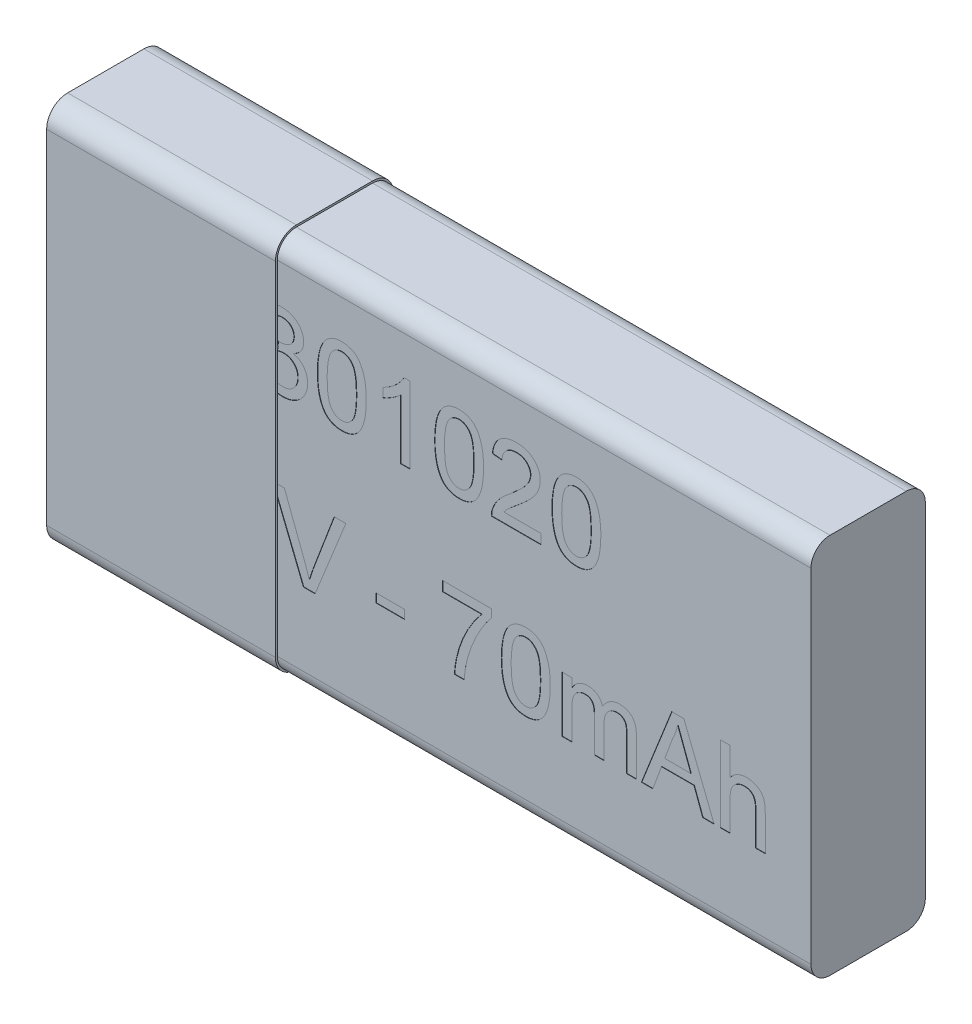
from build123d import *

# Parameters (mm, degrees)
SKETCH1_W           = 20
SKETCH1_H           = 10
BOSS_EXTRUDE1_DEPTH = 3
FILLET1_R           = 0.5
BOSS_EXTRUDE2_DEPTH = 6
SKETCH5_W           = 0.256410257
SKETCH5_H           = 0.256410256
SKETCH5_W_2         = 0.743589744
SKETCH5_H_2         = 0.23076923
CUT_EXTRUDE1_DEPTH  = 0.01


with BuildPart() as part:
    # Sketch1 → Boss-Extrude1 (new body)
    with BuildSketch(Plane.XY):
        Rectangle(SKETCH1_W, SKETCH1_H)
    extrude(amount=BOSS_EXTRUDE1_DEPTH)

    # Fillet1
    fillet1_edges = [part.edges().sort_by_distance(p)[0] for p in [
        (0, 5, 3),
        (0, 5, 0),
        (0, -5, 0),
        (0, -5, 3),
    ]]
    fillet(fillet1_edges, radius=FILLET1_R)

    # Sketch5 → Cut-Extrude1 (cut)
    # profile 1 of 16: a face of its own
    with BuildSketch(Plane.XY.offset(3)):
        with BuildLine():
            Line((-4.487179487, 2.031279474), (-4.230769231, 2.0569205))
            add(Edge.make_bspline(
                [(-4.230769231, 2.0569205), (-4.227350975, 2.041513853), (-4.220736904, 2.011703135), (-4.208010622, 1.968996183), (-4.194568875, 1.929354582), (-4.177905218, 1.89366502), (-4.161645112, 1.86046794), (-4.142537024, 1.831135015), (-4.122119662, 1.80490091), (-4.100015576, 1.781863039), (-4.075970056, 1.762024618), (-4.050303684, 1.744664929), (-4.022473638, 1.730167252), (-3.992692991, 1.718688625), (-3.96121257, 1.709396579), (-3.927861293, 1.702573598), (-3.892462804, 1.698509063), (-3.868200013, 1.698136844), (-3.855769231, 1.697946141)],
                knots=[0, 0, 0, 0, 1.321063709, 2.556160278, 3.730472002, 4.821700466, 5.852032229, 6.822994757, 7.746964065, 8.632786469, 9.490489437, 10.352773447, 11.223141997, 12.11199479, 13.021433979, 13.96892724, 14.959401504, 16, 16, 16, 16], degree=3))
            add(Edge.make_bspline(
                [(-3.855769231, 1.697946141), (-3.841188364, 1.698154029), (-3.812711907, 1.698560034), (-3.771217013, 1.704651664), (-3.731727303, 1.713016053), (-3.694806191, 1.726131893), (-3.659939572, 1.742161875), (-3.627326083, 1.761971532), (-3.596742485, 1.785233026), (-3.568792018, 1.812104585), (-3.543795985, 1.841664156), (-3.521533506, 1.872886607), (-3.503125426, 1.90603835), (-3.487610187, 1.940652433), (-3.476157912, 1.977288203), (-3.467773922, 2.01548883), (-3.462294941, 2.055427074), (-3.461794082, 2.082676722), (-3.461538462, 2.096583961)],
                knots=[0, 0, 0, 0, 1.111377895, 2.170522867, 3.193923215, 4.186422864, 5.152846954, 6.117443035, 7.091571248, 8.078879332, 9.069127402, 10.041602243, 10.999610288, 11.957618333, 12.930786866, 13.922135183, 14.939532534, 16, 16, 16, 16], degree=3))
            add(Edge.make_bspline(
                [(-3.461538462, 2.096583961), (-3.461838891, 2.109818824), (-3.462426656, 2.135711777), (-3.467258565, 2.173717078), (-3.475690139, 2.209794359), (-3.487378315, 2.244152412), (-3.502313406, 2.276740799), (-3.520264945, 2.307828994), (-3.54222115, 2.336735697), (-3.566934794, 2.363771394), (-3.593890169, 2.388679027), (-3.623388687, 2.409866175), (-3.654432215, 2.428151374), (-3.68739072, 2.442915957), (-3.722127357, 2.454634691), (-3.758609011, 2.463057175), (-3.797011079, 2.46789118), (-3.823170091, 2.468479049), (-3.836538462, 2.468779474)],
                knots=[0, 0, 0, 0, 1.072815875, 2.098878726, 3.09954706, 4.07199174, 5.036203424, 6.001873089, 6.97636515, 7.972747947, 8.969130744, 9.945905975, 10.911575641, 11.885646534, 12.868345115, 13.879560892, 14.916365174, 16, 16, 16, 16], degree=3))
            add(Edge.make_bspline(
                [(-3.836538462, 2.468779474), (-3.8483085, 2.468467649), (-3.873287266, 2.467805883), (-3.912712117, 2.461962738), (-3.956381817, 2.453780965), (-3.986558826, 2.445751769), (-4.002403846, 2.441535884)],
                knots=[0, 0, 0, 0, 0.837610211, 1.777604146, 2.833088267, 4, 4, 4, 4], degree=3))
            Line((-4.002403846, 2.441535884), (-3.975961538, 2.672305115))
            add(Edge.make_bspline(
                [(-3.975961538, 2.672305115), (-3.969023695, 2.671546999), (-3.956766915, 2.670207667), (-3.944448324, 2.669714599), (-3.939102564, 2.669500628)],
                knots=[0, 0, 0, 0, 1.132082448, 2, 2, 2, 2], degree=3))
            add(Edge.make_bspline(
                [(-3.939102564, 2.669500628), (-3.915521312, 2.670400951), (-3.869262307, 2.672167102), (-3.801825645, 2.686842338), (-3.737915468, 2.709948022), (-3.688540728, 2.737516456), (-3.651926089, 2.763446065), (-3.628837634, 2.786825286), (-3.608022201, 2.811635363), (-3.592492186, 2.840093419), (-3.579075212, 2.870330791), (-3.57076678, 2.903538609), (-3.564707593, 2.938909678), (-3.564307861, 2.963408641), (-3.564102564, 2.975991013)],
                knots=[0, 0, 0, 0, 1.557468908, 3.055264441, 4.54122591, 6.035034992, 6.780215604, 7.498173296, 8.201377046, 8.913174237, 9.633083494, 10.382644491, 11.169345745, 12, 12, 12, 12], degree=3))
            add(Edge.make_bspline(
                [(-3.564102564, 2.975991013), (-3.564292038, 2.986154218), (-3.564662597, 3.006030582), (-3.568790784, 3.035171429), (-3.5756183, 3.06278328), (-3.584846365, 3.089160952), (-3.596940662, 3.114166204), (-3.61193854, 3.137768425), (-3.629074123, 3.160446405), (-3.649302074, 3.181028293), (-3.670964453, 3.200351631), (-3.694851201, 3.216625843), (-3.719825485, 3.231083089), (-3.746768093, 3.242007755), (-3.775013873, 3.250989611), (-3.804804276, 3.257283733), (-3.836150175, 3.261510657), (-3.857624369, 3.261866832), (-3.868589744, 3.262048705)],
                knots=[0, 0, 0, 0, 1.041493611, 2.036867705, 3.009952345, 3.954088258, 4.897230656, 5.850851638, 6.817653571, 7.805463921, 8.805067469, 9.788883576, 10.763797054, 11.758134544, 12.762883247, 13.799594994, 14.876406454, 16, 16, 16, 16], degree=3))
            add(Edge.make_bspline(
                [(-3.868589744, 3.262048705), (-3.890048705, 3.261211985), (-3.931489141, 3.259596154), (-3.990820065, 3.244646366), (-4.044584595, 3.220455664), (-4.084389261, 3.192086725), (-4.112654074, 3.164964414), (-4.131960439, 3.141975127), (-4.149228888, 3.116588251), (-4.164508363, 3.088812833), (-4.177592435, 3.058537172), (-4.189387362, 3.026136338), (-4.19851773, 2.991091592), (-4.20288736, 2.966809039), (-4.205128205, 2.954356397)],
                knots=[0, 0, 0, 0, 1.533565899, 2.961543033, 4.347411787, 5.731829577, 6.434842101, 7.147085226, 7.87612511, 8.629021686, 9.412189982, 10.234506416, 11.094615066, 12, 12, 12, 12], degree=3))
            Line((-4.205128205, 2.954356397), (-4.461538462, 2.979997423))
            add(Edge.make_bspline(
                [(-4.461538462, 2.979997423), (-4.45752744, 2.999823343), (-4.449659505, 3.038713446), (-4.433629959, 3.094881352), (-4.414082126, 3.14760702), (-4.390611668, 3.196648716), (-4.364327403, 3.24259335), (-4.334006598, 3.28489595), (-4.300360122, 3.32380801), (-4.263328211, 3.359210841), (-4.223413596, 3.39082953), (-4.180817315, 3.418104797), (-4.13588894, 3.441224517), (-4.088586407, 3.459863102), (-4.038947167, 3.475019095), (-3.98683, 3.485059978), (-3.932470806, 3.49185213), (-3.895454411, 3.49249204), (-3.876602564, 3.492817936)],
                knots=[0, 0, 0, 0, 1.136581168, 2.229493434, 3.279335563, 4.293305329, 5.282068175, 6.250623624, 7.213783178, 8.169396253, 9.125981663, 10.071280146, 11.007896369, 11.961295906, 12.925420184, 13.920544621, 14.940967302, 16, 16, 16, 16], degree=3))
            add(Edge.make_bspline(
                [(-3.876602564, 3.492817936), (-3.850507121, 3.491971725), (-3.799195043, 3.4903078), (-3.723829558, 3.477092711), (-3.651742868, 3.455406487), (-3.58351505, 3.425345512), (-3.520319928, 3.388611795), (-3.464397454, 3.344588671), (-3.416495236, 3.294037732), (-3.377543667, 3.237511646), (-3.346699489, 3.177328256), (-3.323875725, 3.114855287), (-3.310238183, 3.050164655), (-3.308542659, 3.006369114), (-3.307692308, 2.984404474)],
                knots=[0, 0, 0, 0, 1.104647871, 2.172094857, 3.229560912, 4.285649672, 5.322588163, 6.317201348, 7.289435229, 8.260615662, 9.214246199, 10.146367077, 11.070353327, 12, 12, 12, 12], degree=3))
            add(Edge.make_bspline(
                [(-3.307692308, 2.984404474), (-3.308554394, 2.963641368), (-3.310256541, 2.922645609), (-3.323361065, 2.862702547), (-3.345505104, 2.805913236), (-3.37543553, 2.752078428), (-3.414247949, 2.702362345), (-3.461835755, 2.658060784), (-3.517437668, 2.618749844), (-3.559106599, 2.598288935), (-3.580528846, 2.587769859)],
                knots=[0, 0, 0, 0, 0.975609618, 1.926294443, 2.868398979, 3.832526731, 4.812148358, 5.820404151, 6.879456693, 8, 8, 8, 8], degree=3))
            add(Edge.make_bspline(
                [(-3.580528846, 2.587769859), (-3.566166659, 2.584143691), (-3.538035325, 2.577041085), (-3.49763235, 2.562324688), (-3.459649019, 2.545095489), (-3.423579795, 2.525581393), (-3.390471839, 2.502502812), (-3.359183946, 2.477269), (-3.330898872, 2.448664679), (-3.304797149, 2.417709357), (-3.281047785, 2.384726988), (-3.261062462, 2.34907599), (-3.24381571, 2.311693565), (-3.229109319, 2.272308579), (-3.218541339, 2.230617346), (-3.2109849, 2.186942846), (-3.205998267, 2.141436821), (-3.205421068, 2.110352527), (-3.205128205, 2.094580756)],
                knots=[0, 0, 0, 0, 1.053251915, 2.063013066, 3.05373318, 4.018979697, 4.975584284, 5.920798056, 6.874756953, 7.832116109, 8.799604348, 9.761196922, 10.734637845, 11.72654167, 12.747371341, 13.789206138, 14.878271633, 16, 16, 16, 16], degree=3))
            add(Edge.make_bspline(
                [(-3.205128205, 2.094580756), (-3.205616221, 2.073048496), (-3.206575329, 2.030730693), (-3.215667701, 1.968564879), (-3.230526677, 1.909001671), (-3.251089507, 1.851838805), (-3.277145866, 1.796842988), (-3.309842299, 1.744790305), (-3.348209759, 1.695257638), (-3.391648423, 1.648719244), (-3.439239637, 1.605949028), (-3.490921874, 1.56891411), (-3.545672606, 1.537463474), (-3.60358093, 1.511815636), (-3.664493333, 1.491665304), (-3.72847041, 1.477220902), (-3.795710137, 1.468731778), (-3.841588812, 1.46770202), (-3.864983974, 1.46717691)],
                knots=[0, 0, 0, 0, 1.016055063, 1.996874249, 2.958724482, 3.910019225, 4.860394196, 5.826121543, 6.806008102, 7.814207964, 8.82789325, 9.821757317, 10.810247154, 11.803791187, 12.806673825, 13.834534493, 14.895752369, 16, 16, 16, 16], degree=3))
            add(Edge.make_bspline(
                [(-3.864983974, 1.46717691), (-3.885979192, 1.467572375), (-3.92731164, 1.46835091), (-3.987813811, 1.476461923), (-4.045778035, 1.487972382), (-4.100745965, 1.505717137), (-4.153356102, 1.52735658), (-4.20271742, 1.555040982), (-4.249717474, 1.586821603), (-4.293473897, 1.623606424), (-4.333743686, 1.66420725), (-4.369669154, 1.708023561), (-4.400518599, 1.754958073), (-4.427718431, 1.804308553), (-4.44970293, 1.857005285), (-4.466821343, 1.912595832), (-4.479874363, 1.970873882), (-4.484717951, 2.010925195), (-4.487179487, 2.031279474)],
                knots=[0, 0, 0, 0, 1.08471039, 2.135426191, 3.150939737, 4.135689946, 5.116584603, 6.086901885, 7.055842759, 8.045878862, 9.036901429, 10.008421467, 10.96965771, 11.936653536, 12.917548193, 13.915472582, 14.940632654, 16, 16, 16, 16], degree=3))
        make_face()
    # profile 2 of 16: a face of its own
    with BuildSketch(Plane.XY.offset(3)):
        with BuildLine():
            add(Edge.make_bspline(
                [(-2.948717949, 2.479196141), (-2.948459615, 2.507777977), (-2.947953649, 2.563757757), (-2.944815304, 2.645666232), (-2.939336009, 2.723451319), (-2.931156929, 2.797045466), (-2.921471366, 2.866614788), (-2.908880073, 2.932060004), (-2.894713038, 2.99352795), (-2.877715138, 3.050954555), (-2.859040011, 3.104833585), (-2.837852483, 3.155078605), (-2.81401364, 3.201636343), (-2.788695013, 3.24498963), (-2.760563778, 3.284464143), (-2.731317878, 3.321167698), (-2.698831898, 3.353754234), (-2.664456674, 3.383062204), (-2.627686021, 3.408924779), (-2.588714493, 3.431241062), (-2.547692042, 3.450944732), (-2.503836825, 3.465777648), (-2.458059268, 3.47786962), (-2.410007, 3.486764621), (-2.359627067, 3.492008524), (-2.325199464, 3.492545084), (-2.307692308, 3.492817936)],
                knots=[0, 0, 0, 0, 1.514747001, 2.966751498, 4.343369068, 5.64627492, 6.890416844, 8.064737671, 9.177176366, 10.232018008, 11.237056675, 12.19799043, 13.119080079, 14.007588942, 14.855863561, 15.685992447, 16.491747269, 17.290132607, 18.077525251, 18.870243746, 19.668095604, 20.485086593, 21.319398728, 22.175900658, 23.072407314, 24, 24, 24, 24], degree=3))
            add(Edge.make_bspline(
                [(-2.307692308, 3.492817936), (-2.282007032, 3.492062807), (-2.231547278, 3.490579326), (-2.157875777, 3.478480324), (-2.088445136, 3.457783115), (-2.023300462, 3.429861689), (-1.963555395, 3.394396103), (-1.910200532, 3.35128228), (-1.863811391, 3.300972907), (-1.824894238, 3.242871834), (-1.790876762, 3.178581876), (-1.760656383, 3.107814477), (-1.733338039, 3.030648939), (-1.713952346, 2.961575011), (-1.700124548, 2.901947944), (-1.690971644, 2.852769227), (-1.683372899, 2.799705114), (-1.677551233, 2.742883982), (-1.672774694, 2.68236956), (-1.669085992, 2.618124172), (-1.667213597, 2.549987247), (-1.666852395, 2.503235545), (-1.666666667, 2.479196141)],
                knots=[0, 0, 0, 0, 1.134486744, 2.228744715, 3.287356444, 4.328707449, 5.352829806, 6.347195599, 7.349461267, 8.364207941, 9.428085653, 10.559314403, 11.761222316, 13.04268526, 13.726896727, 14.465273606, 15.252205015, 16.094778733, 16.988606776, 17.934225168, 18.937792761, 20, 20, 20, 20], degree=3))
            add(Edge.make_bspline(
                [(-1.666666667, 2.479196141), (-1.666929839, 2.450748558), (-1.667443998, 2.395170606), (-1.670498249, 2.313918899), (-1.676307711, 2.236720662), (-1.68345636, 2.163399057), (-1.694270768, 2.094149819), (-1.705923878, 2.028678724), (-1.720335897, 1.96728307), (-1.73715134, 1.909935949), (-1.756089347, 1.85633413), (-1.776857802, 1.806072519), (-1.799860861, 1.759185462), (-1.82578318, 1.71613027), (-1.853438697, 1.67633546), (-1.883029958, 1.63965175), (-1.915184334, 1.606607127), (-1.949869333, 1.577387065), (-1.986381809, 1.551065853), (-2.025448084, 1.528529241), (-2.06689717, 1.509858049), (-2.11045213, 1.493895107), (-2.156554892, 1.4821984), (-2.204841893, 1.473244754), (-2.255491049, 1.467972198), (-2.290051814, 1.467445664), (-2.307692308, 1.46717691)],
                knots=[0, 0, 0, 0, 1.508974709, 2.94807912, 4.311757619, 5.615040294, 6.854280449, 8.028314546, 9.141715822, 10.197470207, 11.196696834, 12.155719058, 13.080757287, 13.963948316, 14.818758719, 15.649605906, 16.461113142, 17.260189315, 18.052359509, 18.845763934, 19.647754795, 20.461145776, 21.303032214, 22.167241874, 23.064524267, 24, 24, 24, 24], degree=3))
            add(Edge.make_bspline(
                [(-2.307692308, 1.46717691), (-2.33082104, 1.467836658), (-2.375915702, 1.469122986), (-2.44177313, 1.47786279), (-2.503583839, 1.493245255), (-2.561869168, 1.51387531), (-2.615973972, 1.541469196), (-2.666156581, 1.575042546), (-2.713425378, 1.613814242), (-2.740636171, 1.64440422), (-2.754407051, 1.659885243)],
                knots=[0, 0, 0, 0, 1.10322584, 2.150986741, 3.161425019, 4.136713905, 5.093944212, 6.049774532, 7.013026876, 8, 8, 8, 8], degree=3))
            add(Edge.make_bspline(
                [(-2.754407051, 1.659885243), (-2.770257651, 1.682749967), (-2.802942267, 1.729898004), (-2.841196776, 1.810289782), (-2.875320475, 1.898789843), (-2.902101323, 1.997134546), (-2.923077402, 2.10454118), (-2.938227369, 2.221220499), (-2.946800758, 2.347122094), (-2.948064459, 2.434177627), (-2.948717949, 2.479196141)],
                knots=[0, 0, 0, 0, 0.779365345, 1.607084704, 2.489375761, 3.438383567, 4.461919411, 5.557722155, 6.737039282, 8, 8, 8, 8], degree=3))
        make_face()
        with BuildLine():
            add(Edge.make_bspline(
                [(-2.692307692, 2.479997423), (-2.692053097, 2.441530149), (-2.691565746, 2.367895277), (-2.68647411, 2.262695158), (-2.677709067, 2.167790291), (-2.666121109, 2.083312078), (-2.650820312, 2.009146245), (-2.631608351, 1.945481789), (-2.609951902, 1.891554594), (-2.583152457, 1.848033044), (-2.553810024, 1.812556632), (-2.523515968, 1.782045771), (-2.491557574, 1.756112237), (-2.458143366, 1.734488959), (-2.422754899, 1.718117233), (-2.38577914, 1.70625097), (-2.347208044, 1.699422118), (-2.320939374, 1.69844094), (-2.307692308, 1.697946141)],
                knots=[0, 0, 0, 0, 1.89448813, 3.626469325, 5.185477471, 6.587276848, 7.82441448, 8.910550357, 9.859733512, 10.6775885, 11.416198291, 12.123144072, 12.791880183, 13.439617036, 14.078171869, 14.70637855, 15.347637704, 16, 16, 16, 16], degree=3))
            add(Edge.make_bspline(
                [(-2.307692308, 1.697946141), (-2.294448558, 1.698451752), (-2.268186467, 1.699454368), (-2.229526248, 1.706132638), (-2.192694354, 1.718609768), (-2.157358651, 1.734923669), (-2.123701579, 1.756054088), (-2.091900141, 1.782085578), (-2.061446502, 1.812578323), (-2.032235875, 1.848467084), (-2.005640604, 1.892189848), (-1.983577907, 1.946073114), (-1.964665354, 2.009849065), (-1.949280599, 2.083977111), (-1.937644838, 2.168321758), (-1.92893279, 2.262963402), (-1.923807079, 2.368028162), (-1.923327771, 2.441529975), (-1.923076923, 2.479997423)],
                knots=[0, 0, 0, 0, 0.652509534, 1.29391342, 1.924290653, 2.562989607, 3.207355802, 3.876242846, 4.583348185, 5.32723334, 6.150888545, 7.094226006, 8.186903555, 9.424320409, 10.81992305, 12.379283064, 14.105084285, 16, 16, 16, 16], degree=3))
            add(Edge.make_bspline(
                [(-1.923076923, 2.479997423), (-1.923319739, 2.517664488), (-1.923784965, 2.589833159), (-1.929042875, 2.693006595), (-1.937282493, 2.786318522), (-1.94855298, 2.869854966), (-1.963531456, 2.943525237), (-1.981698305, 3.007486167), (-2.003346821, 3.061601352), (-2.029086829, 3.106414377), (-2.057740608, 3.143173215), (-2.087672197, 3.174991188), (-2.119629888, 3.202051337), (-2.154179876, 3.223759388), (-2.190208549, 3.241272636), (-2.228543754, 3.2533257), (-2.268808688, 3.260730725), (-2.296441989, 3.261604359), (-2.310496795, 3.262048705)],
                knots=[0, 0, 0, 0, 1.850066095, 3.544656626, 5.0727657, 6.45041401, 7.682899467, 8.762389858, 9.712573485, 10.538438529, 11.291566246, 11.996865408, 12.681389046, 13.341983376, 13.996294293, 14.643563182, 15.31009126, 16, 16, 16, 16], degree=3))
            add(Edge.make_bspline(
                [(-2.310496795, 3.262048705), (-2.323743029, 3.261701044), (-2.349862907, 3.2610155), (-2.388105828, 3.254471993), (-2.424348195, 3.24352979), (-2.459005228, 3.228707513), (-2.491211733, 3.208759657), (-2.52224494, 3.185469115), (-2.550651374, 3.157092189), (-2.567768842, 3.135878043), (-2.576522436, 3.125029474)],
                knots=[0, 0, 0, 0, 1.021318143, 2.013908504, 2.982026795, 3.937174072, 4.91255697, 5.897578595, 6.924855925, 8, 8, 8, 8], degree=3))
            add(Edge.make_bspline(
                [(-2.576522436, 3.125029474), (-2.58605243, 3.109096287), (-2.60617777, 3.075448749), (-2.628696855, 3.016967942), (-2.648589325, 2.950135512), (-2.664967423, 2.873923192), (-2.676815828, 2.788461717), (-2.686169685, 2.693850336), (-2.691028666, 2.589956958), (-2.691869587, 2.517661874), (-2.692307692, 2.479997423)],
                knots=[0, 0, 0, 0, 0.671104906, 1.417232262, 2.260109084, 3.195198885, 4.23592645, 5.382417421, 6.636286093, 8, 8, 8, 8], degree=3))
        make_face(mode=Mode.SUBTRACT)
    # profile 3 of 16: a face of its own
    with BuildSketch(Plane.XY.offset(3)):
        with BuildLine():
            Line((-0.512820513, 1.492817936), (-0.769230769, 1.492817936))
            Line((-0.769230769, 1.492817936), (-0.769230769, 3.051311526))
            add(Edge.make_bspline(
                [(-0.769230769, 3.051311526), (-0.783994894, 3.037073343), (-0.814680511, 3.007480842), (-0.866551304, 2.965600062), (-0.924445737, 2.923152117), (-0.987612016, 2.882333672), (-1.051999351, 2.843907509), (-1.114221421, 2.809349082), (-1.173239402, 2.780104268), (-1.212114865, 2.764113088), (-1.230769231, 2.756439731)],
                knots=[0, 0, 0, 0, 0.893362401, 1.856755847, 2.901947673, 4.020460078, 5.132200827, 6.168787962, 7.121294059, 8, 8, 8, 8], degree=3))
            Line((-1.230769231, 2.756439731), (-1.230769231, 2.992817936))
            add(Edge.make_bspline(
                [(-1.230769231, 2.992817936), (-1.198728429, 3.009319013), (-1.135577906, 3.041841659), (-1.046359873, 3.098012739), (-0.963065241, 3.158904502), (-0.887072868, 3.224503467), (-0.818950547, 3.291557385), (-0.761542878, 3.359217421), (-0.713507794, 3.425003453), (-0.689407682, 3.470881914), (-0.677884615, 3.492817936)],
                knots=[0, 0, 0, 0, 1.141258006, 2.249351951, 3.335817539, 4.406819942, 5.426913362, 6.360259544, 7.215985427, 8, 8, 8, 8], degree=3))
            Line((-0.677884615, 3.492817936), (-0.512820513, 3.492817936))
            Line((-0.512820513, 3.492817936), (-0.512820513, 1.492817936))
        make_face()
    # profile 4 of 16: a face of its own
    with BuildSketch(Plane.XY.offset(3)):
        with BuildLine():
            add(Edge.make_bspline(
                [(0.128205128, 2.479196141), (0.128463462, 2.507777977), (0.128969428, 2.563757757), (0.132107773, 2.645666232), (0.137587068, 2.723451319), (0.145766148, 2.797045466), (0.155451711, 2.866614788), (0.168043004, 2.932060004), (0.182210039, 2.99352795), (0.199207939, 3.050954555), (0.217883066, 3.104833585), (0.239070594, 3.155078605), (0.262909437, 3.201636343), (0.288228064, 3.24498963), (0.316359299, 3.284464143), (0.345605199, 3.321167698), (0.378091179, 3.353754234), (0.412466403, 3.383062204), (0.449237056, 3.408924779), (0.488208584, 3.431241062), (0.529231035, 3.450944732), (0.573086252, 3.465777648), (0.618863809, 3.47786962), (0.666916077, 3.486764621), (0.71729601, 3.492008524), (0.751723613, 3.492545084), (0.769230769, 3.492817936)],
                knots=[0, 0, 0, 0, 1.514747001, 2.966751498, 4.343369068, 5.64627492, 6.890416844, 8.064737671, 9.177176366, 10.232018008, 11.237056675, 12.19799043, 13.119080079, 14.007588942, 14.855863561, 15.685992447, 16.491747269, 17.290132607, 18.077525251, 18.870243746, 19.668095604, 20.485086593, 21.319398728, 22.175900658, 23.072407314, 24, 24, 24, 24], degree=3))
            add(Edge.make_bspline(
                [(0.769230769, 3.492817936), (0.794916045, 3.492062807), (0.845375798, 3.490579326), (0.9190473, 3.478480324), (0.988477941, 3.457783115), (1.053622615, 3.429861689), (1.113367682, 3.394396103), (1.166722545, 3.35128228), (1.213111686, 3.300972907), (1.252028839, 3.242871834), (1.286046315, 3.178581876), (1.316266694, 3.107814477), (1.343585038, 3.030648939), (1.362970731, 2.961575011), (1.376798529, 2.901947944), (1.385951433, 2.852769227), (1.393550178, 2.799705114), (1.399371844, 2.742883982), (1.404148383, 2.68236956), (1.407837085, 2.618124172), (1.40970948, 2.549987247), (1.410070682, 2.503235545), (1.41025641, 2.479196141)],
                knots=[0, 0, 0, 0, 1.134486744, 2.228744715, 3.287356444, 4.328707449, 5.352829806, 6.347195599, 7.349461267, 8.364207941, 9.428085653, 10.559314403, 11.761222316, 13.04268526, 13.726896727, 14.465273606, 15.252205015, 16.094778733, 16.988606776, 17.934225168, 18.937792761, 20, 20, 20, 20], degree=3))
            add(Edge.make_bspline(
                [(1.41025641, 2.479196141), (1.409993238, 2.450748558), (1.409479079, 2.395170606), (1.406424827, 2.313918899), (1.400615366, 2.236720662), (1.393466717, 2.163399057), (1.382652309, 2.094149819), (1.370999199, 2.028678724), (1.35658718, 1.96728307), (1.339771737, 1.909935949), (1.32083373, 1.85633413), (1.300065274, 1.806072519), (1.277062216, 1.759185462), (1.251139897, 1.71613027), (1.22348438, 1.67633546), (1.193893119, 1.63965175), (1.161738743, 1.606607127), (1.127053744, 1.577387065), (1.090541268, 1.551065853), (1.051474993, 1.528529241), (1.010025907, 1.509858049), (0.966470947, 1.493895107), (0.920368185, 1.4821984), (0.872081184, 1.473244754), (0.821432028, 1.467972198), (0.786871263, 1.467445664), (0.769230769, 1.46717691)],
                knots=[0, 0, 0, 0, 1.508974709, 2.94807912, 4.311757619, 5.615040294, 6.854280449, 8.028314546, 9.141715822, 10.197470207, 11.196696834, 12.155719058, 13.080757287, 13.963948316, 14.818758719, 15.649605906, 16.461113142, 17.260189315, 18.052359509, 18.845763934, 19.647754795, 20.461145776, 21.303032214, 22.167241874, 23.064524267, 24, 24, 24, 24], degree=3))
            add(Edge.make_bspline(
                [(0.769230769, 1.46717691), (0.746102037, 1.467836658), (0.701007375, 1.469122986), (0.635149947, 1.47786279), (0.573339238, 1.493245255), (0.515053909, 1.51387531), (0.460949105, 1.541469196), (0.410766496, 1.575042546), (0.363497699, 1.613814242), (0.336286906, 1.64440422), (0.322516026, 1.659885243)],
                knots=[0, 0, 0, 0, 1.10322584, 2.150986741, 3.161425019, 4.136713905, 5.093944212, 6.049774532, 7.013026876, 8, 8, 8, 8], degree=3))
            add(Edge.make_bspline(
                [(0.322516026, 1.659885243), (0.306665426, 1.682749967), (0.27398081, 1.729898004), (0.235726301, 1.810289782), (0.201602602, 1.898789843), (0.174821754, 1.997134546), (0.153845675, 2.10454118), (0.138695708, 2.221220499), (0.130122319, 2.347122094), (0.128858618, 2.434177627), (0.128205128, 2.479196141)],
                knots=[0, 0, 0, 0, 0.779365345, 1.607084704, 2.489375761, 3.438383567, 4.461919411, 5.557722155, 6.737039282, 8, 8, 8, 8], degree=3))
        make_face()
        with BuildLine():
            add(Edge.make_bspline(
                [(0.384615385, 2.479997423), (0.38486998, 2.441530149), (0.385357331, 2.367895277), (0.390448967, 2.262695158), (0.39921401, 2.167790291), (0.410801968, 2.083312078), (0.426102765, 2.009146245), (0.445314726, 1.945481789), (0.466971175, 1.891554594), (0.49377062, 1.848033044), (0.523113052, 1.812556632), (0.553407109, 1.782045771), (0.585365503, 1.756112237), (0.618779711, 1.734488959), (0.654168178, 1.718117233), (0.691143937, 1.70625097), (0.729715033, 1.699422118), (0.755983703, 1.69844094), (0.769230769, 1.697946141)],
                knots=[0, 0, 0, 0, 1.89448813, 3.626469325, 5.185477471, 6.587276848, 7.82441448, 8.910550357, 9.859733512, 10.6775885, 11.416198291, 12.123144072, 12.791880183, 13.439617036, 14.078171869, 14.70637855, 15.347637704, 16, 16, 16, 16], degree=3))
            add(Edge.make_bspline(
                [(0.769230769, 1.697946141), (0.782474519, 1.698451752), (0.80873661, 1.699454368), (0.847396829, 1.706132638), (0.884228723, 1.718609768), (0.919564426, 1.734923669), (0.953221498, 1.756054088), (0.985022936, 1.782085578), (1.015476575, 1.812578323), (1.044687202, 1.848467084), (1.071282473, 1.892189848), (1.09334517, 1.946073114), (1.112257723, 2.009849065), (1.127642478, 2.083977111), (1.139278239, 2.168321758), (1.147990287, 2.262963402), (1.153115998, 2.368028162), (1.153595306, 2.441529975), (1.153846154, 2.479997423)],
                knots=[0, 0, 0, 0, 0.652509534, 1.29391342, 1.924290653, 2.562989607, 3.207355802, 3.876242846, 4.583348185, 5.32723334, 6.150888545, 7.094226006, 8.186903555, 9.424320409, 10.81992305, 12.379283064, 14.105084285, 16, 16, 16, 16], degree=3))
            add(Edge.make_bspline(
                [(1.153846154, 2.479997423), (1.153603338, 2.517664488), (1.153138111, 2.589833159), (1.147880202, 2.693006595), (1.139640584, 2.786318522), (1.128370096, 2.869854966), (1.11339162, 2.943525237), (1.095224772, 3.007486167), (1.073576256, 3.061601352), (1.047836248, 3.106414377), (1.019182469, 3.143173215), (0.98925088, 3.174991188), (0.957293189, 3.202051337), (0.922743201, 3.223759388), (0.886714528, 3.241272636), (0.848379323, 3.2533257), (0.808114389, 3.260730725), (0.780481088, 3.261604359), (0.766426282, 3.262048705)],
                knots=[0, 0, 0, 0, 1.850066095, 3.544656626, 5.0727657, 6.45041401, 7.682899467, 8.762389858, 9.712573485, 10.538438529, 11.291566246, 11.996865408, 12.681389046, 13.341983376, 13.996294293, 14.643563182, 15.31009126, 16, 16, 16, 16], degree=3))
            add(Edge.make_bspline(
                [(0.766426282, 3.262048705), (0.753180047, 3.261701044), (0.72706017, 3.2610155), (0.688817249, 3.254471993), (0.652574882, 3.24352979), (0.617917849, 3.228707513), (0.585711344, 3.208759657), (0.554678137, 3.185469115), (0.526271703, 3.157092189), (0.509154235, 3.135878043), (0.500400641, 3.125029474)],
                knots=[0, 0, 0, 0, 1.021318143, 2.013908504, 2.982026795, 3.937174072, 4.91255697, 5.897578595, 6.924855925, 8, 8, 8, 8], degree=3))
            add(Edge.make_bspline(
                [(0.500400641, 3.125029474), (0.490870647, 3.109096287), (0.470745307, 3.075448749), (0.448226222, 3.016967942), (0.428333752, 2.950135512), (0.411955654, 2.873923192), (0.400107249, 2.788461717), (0.390753392, 2.693850336), (0.385894411, 2.589956958), (0.38505349, 2.517661874), (0.384615385, 2.479997423)],
                knots=[0, 0, 0, 0, 0.671104906, 1.417232262, 2.260109084, 3.195198885, 4.23592645, 5.382417421, 6.636286093, 8, 8, 8, 8], degree=3))
        make_face(mode=Mode.SUBTRACT)
    # profile 5 of 16: a face of its own
    with BuildSketch(Plane.XY.offset(3)):
        with BuildLine():
            Line((2.923076923, 1.749228192), (2.923076923, 1.492817936))
            Line((2.923076923, 1.492817936), (1.615384615, 1.492817936))
            add(Edge.make_bspline(
                [(1.615384615, 1.492817936), (1.615357843, 1.508057118), (1.615304389, 1.538484405), (1.620453176, 1.583484431), (1.628517208, 1.627887495), (1.637635205, 1.656361413), (1.642227564, 1.670702551)],
                knots=[0, 0, 0, 0, 1.01057331, 2.01775941, 3.001627217, 4, 4, 4, 4], degree=3))
            add(Edge.make_bspline(
                [(1.642227564, 1.670702551), (1.650712716, 1.694134259), (1.667989882, 1.741845076), (1.702993601, 1.810685122), (1.744166247, 1.879108838), (1.784253613, 1.934815402), (1.820964984, 1.979321053), (1.851752254, 2.014141573), (1.885870193, 2.04978448), (1.923291478, 2.086243261), (1.963655951, 2.123754046), (2.00701869, 2.162441932), (2.05389174, 2.201585927), (2.086614034, 2.227532195), (2.103365385, 2.240814731)],
                knots=[0, 0, 0, 0, 1.204657718, 2.452881516, 3.728232997, 5.065887527, 5.768225529, 6.518857853, 7.313994055, 8.154655305, 9.046094665, 9.979688118, 10.965752482, 12, 12, 12, 12], degree=3))
            add(Edge.make_bspline(
                [(2.103365385, 2.240814731), (2.129099596, 2.262474799), (2.178652453, 2.304182634), (2.248628853, 2.366073196), (2.312540903, 2.423542089), (2.369370878, 2.477596572), (2.419583586, 2.527712351), (2.463296929, 2.573775884), (2.500887029, 2.615643414), (2.531894985, 2.65483037), (2.558057348, 2.691833755), (2.580227641, 2.727928273), (2.598703638, 2.763744415), (2.614091672, 2.799168849), (2.626262299, 2.834353066), (2.634558312, 2.869399573), (2.640184382, 2.903960624), (2.640747274, 2.926957931), (2.641025641, 2.938330756)],
                knots=[0, 0, 0, 0, 1.782554561, 3.432421876, 4.950675607, 6.337395053, 7.588547463, 8.709982106, 9.702713005, 10.569305638, 11.356701089, 12.103210377, 12.812277205, 13.490692607, 14.148717897, 14.782152033, 15.397739362, 16, 16, 16, 16], degree=3))
            add(Edge.make_bspline(
                [(2.641025641, 2.938330756), (2.640747241, 2.949570887), (2.640201035, 2.971623411), (2.635018662, 3.003897142), (2.627804382, 3.034977517), (2.616141088, 3.06430502), (2.602258256, 3.092748152), (2.584450174, 3.119408147), (2.563849884, 3.14494944), (2.540264295, 3.168698628), (2.514503309, 3.190979157), (2.485719078, 3.20949969), (2.455802143, 3.226173688), (2.423720394, 3.239580538), (2.389525963, 3.249425428), (2.353467769, 3.256570282), (2.315551534, 3.261100503), (2.289676369, 3.261727846), (2.276442308, 3.262048705)],
                knots=[0, 0, 0, 0, 0.988194508, 1.938783882, 2.870742509, 3.789494954, 4.709148727, 5.651055405, 6.603531303, 7.592354411, 8.592907906, 9.593461401, 10.59787167, 11.603930315, 12.645063138, 13.723588815, 14.835711238, 16, 16, 16, 16], degree=3))
            add(Edge.make_bspline(
                [(2.276442308, 3.262048705), (2.262540295, 3.261729435), (2.235333034, 3.261104599), (2.195563304, 3.256556311), (2.15780884, 3.249607142), (2.122159754, 3.238982457), (2.088659437, 3.225597963), (2.057444328, 3.20875045), (2.028014543, 3.189732655), (2.001296939, 3.16721702), (1.97713656, 3.142251773), (1.955687768, 3.115072172), (1.938113706, 3.085153706), (1.923600321, 3.053154214), (1.911930345, 3.018973104), (1.903458338, 2.982349067), (1.898839344, 2.943387849), (1.897910503, 2.916707218), (1.897435897, 2.903074346)],
                knots=[0, 0, 0, 0, 1.131143733, 2.213731411, 3.253917892, 4.251203413, 5.236093891, 6.184197493, 7.13373276, 8.082770301, 9.020476205, 9.957489029, 10.893177274, 11.836722509, 12.812818608, 13.827831385, 14.890097571, 16, 16, 16, 16], degree=3))
            Line((1.897435897, 2.903074346), (1.641025641, 2.928715372))
            add(Edge.make_bspline(
                [(1.641025641, 2.928715372), (1.643649082, 2.951062152), (1.648752761, 2.99453589), (1.661465329, 3.057500276), (1.679312625, 3.116075204), (1.70066842, 3.171077331), (1.727439921, 3.221570356), (1.757702799, 3.268598669), (1.793396467, 3.31067073), (1.8328285, 3.34911271), (1.876430919, 3.38299021), (1.923794148, 3.41258691), (1.97489652, 3.437342722), (2.029453414, 3.457839502), (2.087590078, 3.473390925), (2.149224268, 3.484542762), (2.214455103, 3.491416883), (2.259197728, 3.492344254), (2.282051282, 3.492817936)],
                knots=[0, 0, 0, 0, 1.130804643, 2.199883102, 3.223565206, 4.205909148, 5.160801384, 6.091796021, 7.01151579, 7.927798993, 8.855738875, 9.7815393, 10.730299821, 11.705391175, 12.706931101, 13.751121791, 14.851322166, 16, 16, 16, 16], degree=3))
            add(Edge.make_bspline(
                [(2.282051282, 3.492817936), (2.305178381, 3.49242191), (2.350230106, 3.491650451), (2.41587771, 3.483756869), (2.477818039, 3.471462688), (2.536278164, 3.454328363), (2.590912695, 3.431860153), (2.641763658, 3.404409075), (2.689065517, 3.372242905), (2.732027954, 3.334975509), (2.770768307, 3.294291903), (2.804718513, 3.250873726), (2.83310252, 3.204906461), (2.85726974, 3.157016672), (2.875195459, 3.10619248), (2.887801155, 3.053124851), (2.896367091, 2.997768434), (2.897074892, 2.959998625), (2.897435897, 2.940734602)],
                knots=[0, 0, 0, 0, 1.195390245, 2.328627238, 3.413424916, 4.457841177, 5.473507151, 6.462241215, 7.441013641, 8.425227782, 9.397253344, 10.342087291, 11.269524934, 12.186751184, 13.110685745, 14.048630397, 15.004728144, 16, 16, 16, 16], degree=3))
            add(Edge.make_bspline(
                [(2.897435897, 2.940734602), (2.896884648, 2.920943002), (2.895780933, 2.881316124), (2.88716629, 2.822085629), (2.872426541, 2.763497916), (2.852885566, 2.704839938), (2.826188529, 2.645878884), (2.792461355, 2.585801385), (2.75061911, 2.52438552), (2.710378602, 2.472175211), (2.67292122, 2.428409806), (2.639718791, 2.392388321), (2.601305502, 2.354117902), (2.559122379, 2.312273155), (2.511448993, 2.268339239), (2.45965511, 2.221000527), (2.402606937, 2.171502794), (2.363004387, 2.137688319), (2.342548077, 2.120221782)],
                knots=[0, 0, 0, 0, 0.927118007, 1.856282007, 2.79721255, 3.754929441, 4.749232485, 5.824981375, 6.979078785, 8.228161913, 8.911614355, 9.677694854, 10.522803217, 11.452009355, 12.461436787, 13.560019032, 14.739651695, 16, 16, 16, 16], degree=3))
            add(Edge.make_bspline(
                [(2.342548077, 2.120221782), (2.325030337, 2.105960474), (2.291626704, 2.078766356), (2.244103565, 2.039342315), (2.201537287, 2.003191537), (2.162932464, 1.971493192), (2.129695059, 1.942714072), (2.10065433, 1.918114576), (2.076865344, 1.89645785), (2.04063893, 1.863560847), (1.994755086, 1.816669494), (1.960945906, 1.771106476), (1.944711538, 1.749228192)],
                knots=[0, 0, 0, 0, 1.241996727, 2.368296581, 3.394949853, 4.3125351, 5.114548721, 5.812230366, 6.404953749, 6.883082049, 8.503329734, 10, 10, 10, 10], degree=3))
            Line((1.944711538, 1.749228192), (2.923076923, 1.749228192))
        make_face()
    # profile 6 of 16: a face of its own
    with BuildSketch(Plane.XY.offset(3)):
        with BuildLine():
            add(Edge.make_bspline(
                [(3.205128205, 2.479196141), (3.205386539, 2.507777977), (3.205892505, 2.563757757), (3.20903085, 2.645666232), (3.214510145, 2.723451319), (3.222689225, 2.797045466), (3.232374788, 2.866614788), (3.244966081, 2.932060004), (3.259133116, 2.99352795), (3.276131016, 3.050954555), (3.294806143, 3.104833585), (3.315993671, 3.155078605), (3.339832514, 3.201636343), (3.365151141, 3.24498963), (3.393282376, 3.284464143), (3.422528276, 3.321167698), (3.455014256, 3.353754234), (3.48938948, 3.383062204), (3.526160133, 3.408924779), (3.565131661, 3.431241062), (3.606154112, 3.450944732), (3.650009329, 3.465777648), (3.695786886, 3.47786962), (3.743839154, 3.486764621), (3.794219087, 3.492008524), (3.82864669, 3.492545084), (3.846153846, 3.492817936)],
                knots=[0, 0, 0, 0, 1.514747001, 2.966751498, 4.343369068, 5.64627492, 6.890416844, 8.064737671, 9.177176366, 10.232018008, 11.237056675, 12.19799043, 13.119080079, 14.007588942, 14.855863561, 15.685992447, 16.491747269, 17.290132607, 18.077525251, 18.870243746, 19.668095604, 20.485086593, 21.319398728, 22.175900658, 23.072407314, 24, 24, 24, 24], degree=3))
            add(Edge.make_bspline(
                [(3.846153846, 3.492817936), (3.871839122, 3.492062807), (3.922298875, 3.490579326), (3.995970377, 3.478480324), (4.065401018, 3.457783115), (4.130545692, 3.429861689), (4.190290759, 3.394396103), (4.243645622, 3.35128228), (4.290034763, 3.300972907), (4.328951915, 3.242871834), (4.362969392, 3.178581876), (4.39318977, 3.107814477), (4.420508115, 3.030648939), (4.439893807, 2.961575011), (4.453721606, 2.901947944), (4.46287451, 2.852769227), (4.470473255, 2.799705114), (4.47629492, 2.742883982), (4.48107146, 2.68236956), (4.484760162, 2.618124172), (4.486632556, 2.549987247), (4.486993759, 2.503235545), (4.487179487, 2.479196141)],
                knots=[0, 0, 0, 0, 1.134486744, 2.228744715, 3.287356444, 4.328707449, 5.352829806, 6.347195599, 7.349461267, 8.364207941, 9.428085653, 10.559314403, 11.761222316, 13.04268526, 13.726896727, 14.465273606, 15.252205015, 16.094778733, 16.988606776, 17.934225168, 18.937792761, 20, 20, 20, 20], degree=3))
            add(Edge.make_bspline(
                [(4.487179487, 2.479196141), (4.486916315, 2.450748558), (4.486402156, 2.395170606), (4.483347904, 2.313918899), (4.477538443, 2.236720662), (4.470389794, 2.163399057), (4.459575386, 2.094149819), (4.447922276, 2.028678724), (4.433510257, 1.96728307), (4.416694814, 1.909935949), (4.397756807, 1.85633413), (4.376988351, 1.806072519), (4.353985293, 1.759185462), (4.328062974, 1.71613027), (4.300407457, 1.67633546), (4.270816195, 1.63965175), (4.23866182, 1.606607127), (4.203976821, 1.577387065), (4.167464344, 1.551065853), (4.12839807, 1.528529241), (4.086948984, 1.509858049), (4.043394024, 1.493895107), (3.997291262, 1.4821984), (3.949004261, 1.473244754), (3.898355105, 1.467972198), (3.863794339, 1.467445664), (3.846153846, 1.46717691)],
                knots=[0, 0, 0, 0, 1.508974709, 2.94807912, 4.311757619, 5.615040294, 6.854280449, 8.028314546, 9.141715822, 10.197470207, 11.196696834, 12.155719058, 13.080757287, 13.963948316, 14.818758719, 15.649605906, 16.461113142, 17.260189315, 18.052359509, 18.845763934, 19.647754795, 20.461145776, 21.303032214, 22.167241874, 23.064524267, 24, 24, 24, 24], degree=3))
            add(Edge.make_bspline(
                [(3.846153846, 1.46717691), (3.823025114, 1.467836658), (3.777930452, 1.469122986), (3.712073024, 1.47786279), (3.650262314, 1.493245255), (3.591976986, 1.51387531), (3.537872182, 1.541469196), (3.487689573, 1.575042546), (3.440420776, 1.613814242), (3.413209983, 1.64440422), (3.399439103, 1.659885243)],
                knots=[0, 0, 0, 0, 1.10322584, 2.150986741, 3.161425019, 4.136713905, 5.093944212, 6.049774532, 7.013026876, 8, 8, 8, 8], degree=3))
            add(Edge.make_bspline(
                [(3.399439103, 1.659885243), (3.383588503, 1.682749967), (3.350903887, 1.729898004), (3.312649378, 1.810289782), (3.278525679, 1.898789843), (3.251744831, 1.997134546), (3.230768752, 2.10454118), (3.215618785, 2.221220499), (3.207045396, 2.347122094), (3.205781695, 2.434177627), (3.205128205, 2.479196141)],
                knots=[0, 0, 0, 0, 0.779365345, 1.607084704, 2.489375761, 3.438383567, 4.461919411, 5.557722155, 6.737039282, 8, 8, 8, 8], degree=3))
        make_face()
        with BuildLine():
            add(Edge.make_bspline(
                [(3.461538462, 2.479997423), (3.461793057, 2.441530149), (3.462280408, 2.367895277), (3.467372044, 2.262695158), (3.476137086, 2.167790291), (3.487725045, 2.083312078), (3.503025842, 2.009146245), (3.522237803, 1.945481789), (3.543894252, 1.891554594), (3.570693697, 1.848033044), (3.600036129, 1.812556632), (3.630330186, 1.782045771), (3.66228858, 1.756112237), (3.695702788, 1.734488959), (3.731091255, 1.718117233), (3.768067014, 1.70625097), (3.80663811, 1.699422118), (3.83290678, 1.69844094), (3.846153846, 1.697946141)],
                knots=[0, 0, 0, 0, 1.89448813, 3.626469325, 5.185477471, 6.587276848, 7.82441448, 8.910550357, 9.859733512, 10.6775885, 11.416198291, 12.123144072, 12.791880183, 13.439617036, 14.078171869, 14.70637855, 15.347637704, 16, 16, 16, 16], degree=3))
            add(Edge.make_bspline(
                [(3.846153846, 1.697946141), (3.859397596, 1.698451752), (3.885659687, 1.699454368), (3.924319905, 1.706132638), (3.9611518, 1.718609768), (3.996487503, 1.734923669), (4.030144575, 1.756054088), (4.061946013, 1.782085578), (4.092399652, 1.812578323), (4.121610279, 1.848467084), (4.14820555, 1.892189848), (4.170268247, 1.946073114), (4.1891808, 2.009849065), (4.204565555, 2.083977111), (4.216201316, 2.168321758), (4.224913364, 2.262963402), (4.230039075, 2.368028162), (4.230518383, 2.441529975), (4.230769231, 2.479997423)],
                knots=[0, 0, 0, 0, 0.652509534, 1.29391342, 1.924290653, 2.562989607, 3.207355802, 3.876242846, 4.583348185, 5.32723334, 6.150888545, 7.094226006, 8.186903555, 9.424320409, 10.81992305, 12.379283064, 14.105084285, 16, 16, 16, 16], degree=3))
            add(Edge.make_bspline(
                [(4.230769231, 2.479997423), (4.230526415, 2.517664488), (4.230061188, 2.589833159), (4.224803278, 2.693006595), (4.216563661, 2.786318522), (4.205293173, 2.869854966), (4.190314697, 2.943525237), (4.172147849, 3.007486167), (4.150499333, 3.061601352), (4.124759325, 3.106414377), (4.096105546, 3.143173215), (4.066173957, 3.174991188), (4.034216266, 3.202051337), (3.999666278, 3.223759388), (3.963637605, 3.241272636), (3.9253024, 3.2533257), (3.885037466, 3.260730725), (3.857404165, 3.261604359), (3.843349359, 3.262048705)],
                knots=[0, 0, 0, 0, 1.850066095, 3.544656626, 5.0727657, 6.45041401, 7.682899467, 8.762389858, 9.712573485, 10.538438529, 11.291566246, 11.996865408, 12.681389046, 13.341983376, 13.996294293, 14.643563182, 15.31009126, 16, 16, 16, 16], degree=3))
            add(Edge.make_bspline(
                [(3.843349359, 3.262048705), (3.830103124, 3.261701044), (3.803983247, 3.2610155), (3.765740326, 3.254471993), (3.729497959, 3.24352979), (3.694840926, 3.228707513), (3.662634421, 3.208759657), (3.631601214, 3.185469115), (3.60319478, 3.157092189), (3.586077312, 3.135878043), (3.577323718, 3.125029474)],
                knots=[0, 0, 0, 0, 1.021318143, 2.013908504, 2.982026795, 3.937174072, 4.91255697, 5.897578595, 6.924855925, 8, 8, 8, 8], degree=3))
            add(Edge.make_bspline(
                [(3.577323718, 3.125029474), (3.567793724, 3.109096287), (3.547668384, 3.075448749), (3.525149299, 3.016967942), (3.505256829, 2.950135512), (3.488878731, 2.873923192), (3.477030326, 2.788461717), (3.467676469, 2.693850336), (3.462817488, 2.589956958), (3.461976567, 2.517661874), (3.461538462, 2.479997423)],
                knots=[0, 0, 0, 0, 0.671104906, 1.417232262, 2.260109084, 3.195198885, 4.23592645, 5.382417421, 6.636286093, 8, 8, 8, 8], degree=3))
        make_face(mode=Mode.SUBTRACT)
    # profile 7 of 16: a face of its own
    with BuildSketch(Plane.XY.offset(3)):
        with BuildLine():
            Line((-7.814716201, -2.045643603), (-7.558305945, -2.020002577))
            add(Edge.make_bspline(
                [(-7.558305945, -2.020002577), (-7.554887689, -2.035409224), (-7.548273618, -2.065219942), (-7.535547336, -2.107926894), (-7.522105589, -2.147568495), (-7.505441933, -2.183258057), (-7.489181826, -2.216455137), (-7.470073738, -2.245788062), (-7.449656376, -2.272022167), (-7.42755229, -2.295060038), (-7.403506771, -2.314898459), (-7.377840398, -2.332258147), (-7.350010352, -2.346755825), (-7.320229705, -2.358234452), (-7.288749284, -2.367526498), (-7.255398007, -2.374349479), (-7.219999518, -2.378414014), (-7.195736727, -2.378786233), (-7.183305945, -2.378976936)],
                knots=[0, 0, 0, 0, 1.321063709, 2.556160278, 3.730472002, 4.821700466, 5.852032229, 6.822994757, 7.746964065, 8.632786469, 9.490489437, 10.352773447, 11.223141997, 12.11199479, 13.021433979, 13.96892724, 14.959401504, 16, 16, 16, 16], degree=3))
            add(Edge.make_bspline(
                [(-7.183305945, -2.378976936), (-7.168725078, -2.378769048), (-7.140248621, -2.378363043), (-7.098753727, -2.372271413), (-7.059264017, -2.363907024), (-7.022342905, -2.350791184), (-6.987476287, -2.334761202), (-6.954862797, -2.314951545), (-6.924279199, -2.291690051), (-6.896328732, -2.264818492), (-6.871332699, -2.235258921), (-6.84907022, -2.20403647), (-6.83066214, -2.170884727), (-6.815146901, -2.136270644), (-6.803694626, -2.099634874), (-6.795310636, -2.061434247), (-6.789831655, -2.021496002), (-6.789330796, -1.994246355), (-6.789075176, -1.980339116)],
                knots=[0, 0, 0, 0, 1.111377895, 2.170522867, 3.193923215, 4.186422864, 5.152846954, 6.117443035, 7.091571248, 8.078879332, 9.069127402, 10.041602243, 10.999610288, 11.957618333, 12.930786866, 13.922135183, 14.939532534, 16, 16, 16, 16], degree=3))
            add(Edge.make_bspline(
                [(-6.789075176, -1.980339116), (-6.789375605, -1.967104253), (-6.78996337, -1.941211299), (-6.794795279, -1.903205999), (-6.803226853, -1.867128718), (-6.814915029, -1.832770665), (-6.82985012, -1.800182278), (-6.84780166, -1.769094083), (-6.869757864, -1.740187379), (-6.894471508, -1.713151683), (-6.921426883, -1.68824405), (-6.950925402, -1.667056902), (-6.981968929, -1.648771703), (-7.014927434, -1.63400712), (-7.049664071, -1.622288386), (-7.086145725, -1.613865902), (-7.124547793, -1.609031897), (-7.150706805, -1.608444028), (-7.164075176, -1.608143603)],
                knots=[0, 0, 0, 0, 1.072815875, 2.098878726, 3.09954706, 4.07199174, 5.036203424, 6.001873089, 6.97636515, 7.972747947, 8.969130744, 9.945905975, 10.911575641, 11.885646534, 12.868345115, 13.879560892, 14.916365174, 16, 16, 16, 16], degree=3))
            add(Edge.make_bspline(
                [(-7.164075176, -1.608143603), (-7.175845214, -1.608455428), (-7.20082398, -1.609117194), (-7.240248831, -1.614960339), (-7.283918531, -1.623142112), (-7.314095541, -1.631171308), (-7.32994056, -1.635387192)],
                knots=[0, 0, 0, 0, 0.837610211, 1.777604146, 2.833088267, 4, 4, 4, 4], degree=3))
            Line((-7.32994056, -1.635387192), (-7.303498253, -1.404617962))
            add(Edge.make_bspline(
                [(-7.303498253, -1.404617962), (-7.296560409, -1.405376078), (-7.284303629, -1.40671541), (-7.271985039, -1.407208478), (-7.266639278, -1.407422449)],
                knots=[0, 0, 0, 0, 1.132082448, 2, 2, 2, 2], degree=3))
            add(Edge.make_bspline(
                [(-7.266639278, -1.407422449), (-7.243058026, -1.406522126), (-7.196799021, -1.404755975), (-7.129362359, -1.390080739), (-7.065452182, -1.366975055), (-7.016077442, -1.339406621), (-6.979462803, -1.313477012), (-6.956374348, -1.290097791), (-6.935558915, -1.265287714), (-6.9200289, -1.236829658), (-6.906611926, -1.206592286), (-6.898303495, -1.173384468), (-6.892244307, -1.138013399), (-6.891844576, -1.113514436), (-6.891639278, -1.100932064)],
                knots=[0, 0, 0, 0, 1.557468908, 3.055264441, 4.54122591, 6.035034992, 6.780215604, 7.498173296, 8.201377046, 8.913174237, 9.633083494, 10.382644491, 11.169345745, 12, 12, 12, 12], degree=3))
            add(Edge.make_bspline(
                [(-6.891639278, -1.100932064), (-6.891828753, -1.090768858), (-6.892199311, -1.070892495), (-6.896327499, -1.041751648), (-6.903155014, -1.014139797), (-6.91238308, -0.987762125), (-6.924477376, -0.962756873), (-6.939475254, -0.939154652), (-6.956610838, -0.916476672), (-6.976838788, -0.895894783), (-6.998501168, -0.876571446), (-7.022387915, -0.860297234), (-7.047362199, -0.845839988), (-7.074304807, -0.834915322), (-7.102550587, -0.825933466), (-7.132340991, -0.819639344), (-7.163686889, -0.81541242), (-7.185161083, -0.815056245), (-7.196126458, -0.814874372)],
                knots=[0, 0, 0, 0, 1.041493611, 2.036867705, 3.009952345, 3.954088258, 4.897230656, 5.850851638, 6.817653571, 7.805463921, 8.805067469, 9.788883576, 10.763797054, 11.758134544, 12.762883247, 13.799594994, 14.876406454, 16, 16, 16, 16], degree=3))
            add(Edge.make_bspline(
                [(-7.196126458, -0.814874372), (-7.217585419, -0.815711092), (-7.259025855, -0.817326923), (-7.318356779, -0.832276711), (-7.37212131, -0.856467412), (-7.411925976, -0.884836352), (-7.440190789, -0.911958663), (-7.459497153, -0.934947949), (-7.476765602, -0.960334826), (-7.492045077, -0.988110243), (-7.505129149, -1.018385905), (-7.516924076, -1.050786739), (-7.526054445, -1.085831485), (-7.530424074, -1.110114038), (-7.532664919, -1.12256668)],
                knots=[0, 0, 0, 0, 1.533565899, 2.961543033, 4.347411787, 5.731829577, 6.434842101, 7.147085226, 7.87612511, 8.629021686, 9.412189982, 10.234506416, 11.094615066, 12, 12, 12, 12], degree=3))
            Line((-7.532664919, -1.12256668), (-7.789075176, -1.096925654))
            add(Edge.make_bspline(
                [(-7.789075176, -1.096925654), (-7.785064154, -1.077099734), (-7.777196219, -1.038209631), (-7.761166673, -0.982041725), (-7.74161884, -0.929316057), (-7.718148382, -0.880274361), (-7.691864118, -0.834329726), (-7.661543312, -0.792027127), (-7.627896836, -0.753115067), (-7.590864925, -0.717712236), (-7.55095031, -0.686093547), (-7.508354029, -0.65881828), (-7.463425654, -0.63569856), (-7.416123121, -0.617059975), (-7.366483881, -0.601903982), (-7.314366714, -0.591863099), (-7.26000752, -0.585070947), (-7.222991125, -0.584431037), (-7.204139278, -0.584105141)],
                knots=[0, 0, 0, 0, 1.136581168, 2.229493434, 3.279335563, 4.293305329, 5.282068175, 6.250623624, 7.213783178, 8.169396253, 9.125981663, 10.071280146, 11.007896369, 11.961295906, 12.925420184, 13.920544621, 14.940967302, 16, 16, 16, 16], degree=3))
            add(Edge.make_bspline(
                [(-7.204139278, -0.584105141), (-7.178043835, -0.584951352), (-7.126731757, -0.586615277), (-7.051366272, -0.599830365), (-6.979279582, -0.62151659), (-6.911051764, -0.651577565), (-6.847856642, -0.688311282), (-6.791934168, -0.732334406), (-6.74403195, -0.782885345), (-6.705080382, -0.839411431), (-6.674236204, -0.899594821), (-6.651412439, -0.96206779), (-6.637774897, -1.026758422), (-6.636079373, -1.070553963), (-6.635229022, -1.092518603)],
                knots=[0, 0, 0, 0, 1.104647871, 2.172094857, 3.229560912, 4.285649672, 5.322588163, 6.317201348, 7.289435229, 8.260615662, 9.214246199, 10.146367077, 11.070353327, 12, 12, 12, 12], degree=3))
            add(Edge.make_bspline(
                [(-6.635229022, -1.092518603), (-6.636091108, -1.113281709), (-6.637793255, -1.154277468), (-6.650897779, -1.21422053), (-6.673041818, -1.271009841), (-6.702972244, -1.324844649), (-6.741784663, -1.374560732), (-6.789372469, -1.418862293), (-6.844974382, -1.458173233), (-6.886643313, -1.478634142), (-6.90806556, -1.489153218)],
                knots=[0, 0, 0, 0, 0.975609618, 1.926294443, 2.868398979, 3.832526731, 4.812148358, 5.820404151, 6.879456693, 8, 8, 8, 8], degree=3))
            add(Edge.make_bspline(
                [(-6.90806556, -1.489153218), (-6.893703373, -1.492779386), (-6.865572039, -1.499881991), (-6.825169065, -1.514598389), (-6.787185733, -1.531827588), (-6.75111651, -1.551341684), (-6.718008553, -1.574420265), (-6.68672066, -1.599654077), (-6.658435587, -1.628258398), (-6.632333863, -1.65921372), (-6.608584499, -1.692196089), (-6.588599176, -1.727847087), (-6.571352424, -1.765229512), (-6.556646033, -1.804614497), (-6.546078053, -1.846305731), (-6.538521614, -1.88998023), (-6.533534981, -1.935486256), (-6.532957782, -1.96657055), (-6.532664919, -1.982342321)],
                knots=[0, 0, 0, 0, 1.053251915, 2.063013066, 3.05373318, 4.018979697, 4.975584284, 5.920798056, 6.874756953, 7.832116109, 8.799604348, 9.761196922, 10.734637845, 11.72654167, 12.747371341, 13.789206138, 14.878271633, 16, 16, 16, 16], degree=3))
            add(Edge.make_bspline(
                [(-6.532664919, -1.982342321), (-6.533152935, -2.003874581), (-6.534112043, -2.046192383), (-6.543204415, -2.108358198), (-6.558063391, -2.167921405), (-6.578626221, -2.225084272), (-6.60468258, -2.280080089), (-6.637379014, -2.332132772), (-6.675746473, -2.381665439), (-6.719185137, -2.428203833), (-6.766776351, -2.470974049), (-6.818458588, -2.508008967), (-6.87320932, -2.539459603), (-6.931117644, -2.565107441), (-6.992030047, -2.585257773), (-7.056007124, -2.599702175), (-7.123246851, -2.608191299), (-7.169125526, -2.609221057), (-7.192520689, -2.609746167)],
                knots=[0, 0, 0, 0, 1.016055063, 1.996874249, 2.958724482, 3.910019225, 4.860394196, 5.826121543, 6.806008102, 7.814207964, 8.82789325, 9.821757317, 10.810247154, 11.803791187, 12.806673825, 13.834534493, 14.895752369, 16, 16, 16, 16], degree=3))
            add(Edge.make_bspline(
                [(-7.192520689, -2.609746167), (-7.213515906, -2.609350702), (-7.254848354, -2.608572167), (-7.315350525, -2.600461154), (-7.373314749, -2.588950695), (-7.428282679, -2.571205939), (-7.480892816, -2.549566497), (-7.530254134, -2.521882095), (-7.577254188, -2.490101474), (-7.621010611, -2.453316653), (-7.6612804, -2.412715827), (-7.697205868, -2.368899515), (-7.728055313, -2.321965004), (-7.755255145, -2.272614524), (-7.777239644, -2.219917792), (-7.794358057, -2.164327244), (-7.807411077, -2.106049195), (-7.812254665, -2.065997882), (-7.814716201, -2.045643603)],
                knots=[0, 0, 0, 0, 1.08471039, 2.135426191, 3.150939737, 4.135689946, 5.116584603, 6.086901885, 7.055842759, 8.045878862, 9.036901429, 10.008421467, 10.96965771, 11.936653536, 12.917548193, 13.915472582, 14.940632654, 16, 16, 16, 16], degree=3))
        make_face()
    # profile 8 of 16: a face of its own
    with BuildSketch(Plane.XY.offset(3)):
        with Locations((-6.019844407, -2.455900013)):
            Rectangle(SKETCH5_W, SKETCH5_H)
    # profile 9 of 16: a face of its own
    with BuildSketch(Plane.XY.offset(3)):
        with BuildLine():
            Line((-5.507023894, -0.866156423), (-5.507023894, -0.609746167))
            Line((-5.507023894, -0.609746167), (-4.224972612, -0.609746167))
            Line((-4.224972612, -0.609746167), (-4.224972612, -0.817278218))
            add(Edge.make_bspline(
                [(-4.224972612, -0.817278218), (-4.240065701, -0.834928324), (-4.270925767, -0.871016591), (-4.315632875, -0.928499405), (-4.36057229, -0.989698988), (-4.404954108, -1.055203834), (-4.449441483, -1.12453589), (-4.493855368, -1.197916589), (-4.538377076, -1.275167197), (-4.596776229, -1.383333106), (-4.666449431, -1.521812739), (-4.738846503, -1.692444567), (-4.803118371, -1.864777098), (-4.837320942, -1.981979783), (-4.854379663, -2.040435269)],
                knots=[0, 0, 0, 0, 0.603281671, 1.233499104, 1.891379699, 2.575603978, 3.288773649, 4.031381703, 4.80386477, 5.604951941, 7.224880277, 8.828980706, 10.418436603, 12, 12, 12, 12], degree=3))
            add(Edge.make_bspline(
                [(-4.854379663, -2.040435269), (-4.865442967, -2.082651868), (-4.887949837, -2.168536108), (-4.912587927, -2.301903456), (-4.931636824, -2.440959004), (-4.939116974, -2.535846163), (-4.94292133, -2.584105141)],
                knots=[0, 0, 0, 0, 0.948866074, 1.930345965, 2.947387709, 4, 4, 4, 4], degree=3))
            Line((-4.94292133, -2.584105141), (-5.199331586, -2.584105141))
            add(Edge.make_bspline(
                [(-5.199331586, -2.584105141), (-5.198716571, -2.564196154), (-5.197451828, -2.523254495), (-5.191859033, -2.460343278), (-5.184409943, -2.394305859), (-5.173888734, -2.325365327), (-5.160515414, -2.253381741), (-5.144579352, -2.178278855), (-5.125547032, -2.100211998), (-5.097399317, -1.991977421), (-5.055595384, -1.855881373), (-4.994731885, -1.694960276), (-4.924737215, -1.536800589), (-4.857932728, -1.408541462), (-4.800964845, -1.308663489), (-4.757734119, -1.236194317), (-4.713274053, -1.167139221), (-4.6684089, -1.101001439), (-4.623130883, -1.037725272), (-4.576517666, -0.977902182), (-4.529943568, -0.920330328), (-4.497427015, -0.884055138), (-4.481382868, -0.866156423)],
                knots=[0, 0, 0, 0, 0.630312875, 1.296201307, 1.998242258, 2.7335219, 3.502880474, 4.315318118, 5.163159648, 6.045885937, 7.85484959, 9.666009448, 11.488277305, 13.325849397, 14.240191093, 15.127469759, 15.996293014, 16.839220888, 17.656853801, 18.458354243, 19.239329216, 20, 20, 20, 20], degree=3))
            Line((-4.481382868, -0.866156423), (-5.507023894, -0.866156423))
        make_face()
    # profile 10 of 16: a face of its own
    with BuildSketch(Plane.XY.offset(3)):
        with BuildLine():
            Line((-3.31431556, -2.584105141), (-4.120405304, -0.584105141))
            Line((-4.120405304, -0.584105141), (-3.814716201, -0.584105141))
            Line((-3.814716201, -0.584105141), (-3.270645689, -2.017598731))
            add(Edge.make_bspline(
                [(-3.270645689, -2.017598731), (-3.259998768, -2.045875007), (-3.239171195, -2.101189235), (-3.210127129, -2.183271757), (-3.184163482, -2.26264974), (-3.168510328, -2.314975349), (-3.160870047, -2.340515398)],
                knots=[0, 0, 0, 0, 1.062747156, 2.078952616, 3.062339733, 4, 4, 4, 4], degree=3))
            add(Edge.make_bspline(
                [(-3.160870047, -2.340515398), (-3.144605016, -2.286507123), (-3.111841753, -2.177716227), (-3.072238766, -2.071223892), (-3.05229633, -2.017598731)],
                knots=[0, 0, 0, 0, 0.992882236, 2, 2, 2, 2], degree=3))
            Line((-3.05229633, -2.017598731), (-2.507023894, -0.584105141))
            Line((-2.507023894, -0.584105141), (-2.201735432, -0.584105141))
            Line((-2.201735432, -0.584105141), (-3.009027099, -2.584105141))
            Line((-3.009027099, -2.584105141), (-3.31431556, -2.584105141))
        make_face()
    # profile 11 of 16: a face of its own
    with BuildSketch(Plane.XY.offset(3)):
        with Locations((-1.032664919, -1.878976936)):
            Rectangle(SKETCH5_W_2, SKETCH5_H_2)
    # profile 12 of 16: a face of its own
    with BuildSketch(Plane.XY.offset(3)):
        with BuildLine():
            Line((0.339129953, -0.866156423), (0.339129953, -0.609746167))
            Line((0.339129953, -0.609746167), (1.621181235, -0.609746167))
            Line((1.621181235, -0.609746167), (1.621181235, -0.817278218))
            add(Edge.make_bspline(
                [(1.621181235, -0.817278218), (1.606088145, -0.834928324), (1.575228079, -0.871016591), (1.530520971, -0.928499405), (1.485581557, -0.989698988), (1.441199738, -1.055203834), (1.396712364, -1.12453589), (1.352298479, -1.197916589), (1.30777677, -1.275167197), (1.249377617, -1.383333106), (1.179704415, -1.521812739), (1.107307343, -1.692444567), (1.043035476, -1.864777098), (1.008832905, -1.981979783), (0.991774183, -2.040435269)],
                knots=[0, 0, 0, 0, 0.603281671, 1.233499104, 1.891379699, 2.575603978, 3.288773649, 4.031381703, 4.80386477, 5.604951941, 7.224880277, 8.828980706, 10.418436603, 12, 12, 12, 12], degree=3))
            add(Edge.make_bspline(
                [(0.991774183, -2.040435269), (0.980710879, -2.082651868), (0.95820401, -2.168536108), (0.933565919, -2.301903456), (0.914517023, -2.440959004), (0.907036872, -2.535846163), (0.903232517, -2.584105141)],
                knots=[0, 0, 0, 0, 0.948866074, 1.930345965, 2.947387709, 4, 4, 4, 4], degree=3))
            Line((0.903232517, -2.584105141), (0.64682226, -2.584105141))
            add(Edge.make_bspline(
                [(0.64682226, -2.584105141), (0.647437275, -2.564196154), (0.648702018, -2.523254495), (0.654294813, -2.460343278), (0.661743903, -2.394305859), (0.672265112, -2.325365327), (0.685638433, -2.253381741), (0.701574494, -2.178278855), (0.720606814, -2.100211998), (0.748754529, -1.991977421), (0.790558462, -1.855881373), (0.851421961, -1.694960276), (0.921416631, -1.536800589), (0.988221118, -1.408541462), (1.045189001, -1.308663489), (1.088419727, -1.236194317), (1.132879793, -1.167139221), (1.177744946, -1.101001439), (1.223022964, -1.037725272), (1.26963618, -0.977902182), (1.316210279, -0.920330328), (1.348726831, -0.884055138), (1.364770978, -0.866156423)],
                knots=[0, 0, 0, 0, 0.630312875, 1.296201307, 1.998242258, 2.7335219, 3.502880474, 4.315318118, 5.163159648, 6.045885937, 7.85484959, 9.666009448, 11.488277305, 13.325849397, 14.240191093, 15.127469759, 15.996293014, 16.839220888, 17.656853801, 18.458354243, 19.239329216, 20, 20, 20, 20], degree=3))
            Line((1.364770978, -0.866156423), (0.339129953, -0.866156423))
        make_face()
    # profile 13 of 16: a face of its own
    with BuildSketch(Plane.XY.offset(3)):
        with BuildLine():
            add(Edge.make_bspline(
                [(1.877591491, -1.597726936), (1.877849824, -1.5691451), (1.878355791, -1.51316532), (1.881494135, -1.431256845), (1.886973431, -1.353471758), (1.895152511, -1.279877611), (1.904838074, -1.210308289), (1.917429367, -1.144863073), (1.931596402, -1.083395127), (1.948594302, -1.025968521), (1.967269429, -0.972089492), (1.988456957, -0.921844472), (2.0122958, -0.875286734), (2.037614427, -0.831933447), (2.065745662, -0.792458934), (2.094991561, -0.755755379), (2.127477542, -0.723168843), (2.161852766, -0.693860873), (2.198623419, -0.667998298), (2.237594947, -0.645682014), (2.278617398, -0.625978345), (2.322472615, -0.611145428), (2.368250171, -0.599053457), (2.41630244, -0.590158456), (2.466682373, -0.584914552), (2.501109976, -0.584377993), (2.518617132, -0.584105141)],
                knots=[0, 0, 0, 0, 1.514747001, 2.966751498, 4.343369068, 5.64627492, 6.890416844, 8.064737671, 9.177176366, 10.232018008, 11.237056675, 12.19799043, 13.119080079, 14.007588942, 14.855863561, 15.685992447, 16.491747269, 17.290132607, 18.077525251, 18.870243746, 19.668095604, 20.485086593, 21.319398728, 22.175900658, 23.072407314, 24, 24, 24, 24], degree=3))
            add(Edge.make_bspline(
                [(2.518617132, -0.584105141), (2.544302407, -0.58486027), (2.594762161, -0.586343751), (2.668433662, -0.598442753), (2.737864304, -0.619139961), (2.803008977, -0.647061388), (2.862754045, -0.682526974), (2.916108908, -0.725640797), (2.962498049, -0.77595017), (3.001415201, -0.834051243), (3.035432677, -0.898341201), (3.065653056, -0.9691086), (3.092971401, -1.046274138), (3.112357093, -1.115348066), (3.126184892, -1.174975132), (3.135337795, -1.22415385), (3.142936541, -1.277217963), (3.148758206, -1.334039095), (3.153534746, -1.394553516), (3.157223448, -1.458798905), (3.159095842, -1.52693583), (3.159457045, -1.573687532), (3.159642773, -1.597726936)],
                knots=[0, 0, 0, 0, 1.134486744, 2.228744715, 3.287356444, 4.328707449, 5.352829806, 6.347195599, 7.349461267, 8.364207941, 9.428085653, 10.559314403, 11.761222316, 13.04268526, 13.726896727, 14.465273606, 15.252205015, 16.094778733, 16.988606776, 17.934225168, 18.937792761, 20, 20, 20, 20], degree=3))
            add(Edge.make_bspline(
                [(3.159642773, -1.597726936), (3.159379601, -1.626174519), (3.158865442, -1.681752471), (3.15581119, -1.763004178), (3.150001729, -1.840202415), (3.14285308, -1.913524019), (3.132038672, -1.982773258), (3.120385562, -2.048244353), (3.105973542, -2.109640006), (3.089158099, -2.166987128), (3.070220092, -2.220588947), (3.049451637, -2.270850558), (3.026448579, -2.317737615), (3.00052626, -2.360792807), (2.972870743, -2.400587617), (2.943279481, -2.437271327), (2.911125106, -2.47031595), (2.876440107, -2.499536012), (2.83992763, -2.525857224), (2.800861356, -2.548393836), (2.75941227, -2.567065028), (2.71585731, -2.583027969), (2.669754548, -2.594724677), (2.621467547, -2.603678323), (2.570818391, -2.608950879), (2.536257625, -2.609477413), (2.518617132, -2.609746167)],
                knots=[0, 0, 0, 0, 1.508974709, 2.94807912, 4.311757619, 5.615040294, 6.854280449, 8.028314546, 9.141715822, 10.197470207, 11.196696834, 12.155719058, 13.080757287, 13.963948316, 14.818758719, 15.649605906, 16.461113142, 17.260189315, 18.052359509, 18.845763934, 19.647754795, 20.461145776, 21.303032214, 22.167241874, 23.064524267, 24, 24, 24, 24], degree=3))
            add(Edge.make_bspline(
                [(2.518617132, -2.609746167), (2.4954884, -2.609086418), (2.450393738, -2.607800091), (2.38453631, -2.599060287), (2.3227256, -2.583677822), (2.264440272, -2.563047767), (2.210335468, -2.535453881), (2.160152859, -2.501880531), (2.112884062, -2.463108835), (2.085673269, -2.432518857), (2.071902388, -2.417037833)],
                knots=[0, 0, 0, 0, 1.10322584, 2.150986741, 3.161425019, 4.136713905, 5.093944212, 6.049774532, 7.013026876, 8, 8, 8, 8], degree=3))
            add(Edge.make_bspline(
                [(2.071902388, -2.417037833), (2.056051788, -2.39417311), (2.023367173, -2.347025072), (1.985112664, -2.266633294), (1.950988964, -2.178133234), (1.924208117, -2.079788531), (1.903232037, -1.972381897), (1.888082071, -1.855702578), (1.879508681, -1.729800983), (1.878244981, -1.64274545), (1.877591491, -1.597726936)],
                knots=[0, 0, 0, 0, 0.779365345, 1.607084704, 2.489375761, 3.438383567, 4.461919411, 5.557722155, 6.737039282, 8, 8, 8, 8], degree=3))
        make_face()
        with BuildLine():
            add(Edge.make_bspline(
                [(2.134001747, -1.596925654), (2.134256342, -1.635392928), (2.134743694, -1.7090278), (2.13983533, -1.814227919), (2.148600372, -1.909132786), (2.160188331, -1.993610999), (2.175489128, -2.067776832), (2.194701089, -2.131441288), (2.216357538, -2.185368483), (2.243156983, -2.228890033), (2.272499415, -2.264366445), (2.302793471, -2.294877306), (2.334751866, -2.32081084), (2.368166074, -2.342434118), (2.403554541, -2.358805843), (2.4405303, -2.370672107), (2.479101396, -2.377500959), (2.505370065, -2.378482137), (2.518617132, -2.378976936)],
                knots=[0, 0, 0, 0, 1.89448813, 3.626469325, 5.185477471, 6.587276848, 7.82441448, 8.910550357, 9.859733512, 10.6775885, 11.416198291, 12.123144072, 12.791880183, 13.439617036, 14.078171869, 14.70637855, 15.347637704, 16, 16, 16, 16], degree=3))
            add(Edge.make_bspline(
                [(2.518617132, -2.378976936), (2.531860881, -2.378471325), (2.558122973, -2.377468709), (2.596783191, -2.370790439), (2.633615086, -2.358313309), (2.668950789, -2.341999408), (2.702607861, -2.320868989), (2.734409298, -2.294837499), (2.764862938, -2.264344754), (2.794073565, -2.228455993), (2.820668835, -2.184733229), (2.842731533, -2.130849963), (2.861644086, -2.067074012), (2.877028841, -1.992945966), (2.888664602, -1.908601319), (2.89737665, -1.813959675), (2.902502361, -1.708894915), (2.902981669, -1.635393102), (2.903232517, -1.596925654)],
                knots=[0, 0, 0, 0, 0.652509534, 1.29391342, 1.924290653, 2.562989607, 3.207355802, 3.876242846, 4.583348185, 5.32723334, 6.150888545, 7.094226006, 8.186903555, 9.424320409, 10.81992305, 12.379283064, 14.105084285, 16, 16, 16, 16], degree=3))
            add(Edge.make_bspline(
                [(2.903232517, -1.596925654), (2.902989701, -1.559258589), (2.902524474, -1.487089918), (2.897266564, -1.383916482), (2.889026947, -1.290604555), (2.877756459, -1.207068111), (2.862777983, -1.13339784), (2.844611135, -1.06943691), (2.822962619, -1.015321725), (2.797222611, -0.9705087), (2.768568832, -0.933749862), (2.738637243, -0.901931889), (2.706679551, -0.87487174), (2.672129564, -0.853163689), (2.636100891, -0.835650441), (2.597765685, -0.823597377), (2.557500752, -0.816192352), (2.529867451, -0.815318718), (2.515812645, -0.814874372)],
                knots=[0, 0, 0, 0, 1.850066095, 3.544656626, 5.0727657, 6.45041401, 7.682899467, 8.762389858, 9.712573485, 10.538438529, 11.291566246, 11.996865408, 12.681389046, 13.341983376, 13.996294293, 14.643563182, 15.31009126, 16, 16, 16, 16], degree=3))
            add(Edge.make_bspline(
                [(2.515812645, -0.814874372), (2.50256641, -0.815222033), (2.476446533, -0.815907577), (2.438203612, -0.822451084), (2.401961245, -0.833393287), (2.367304212, -0.848215564), (2.335097707, -0.86816342), (2.304064499, -0.891453962), (2.275658066, -0.919830888), (2.258540598, -0.941045034), (2.249787004, -0.951893603)],
                knots=[0, 0, 0, 0, 1.021318143, 2.013908504, 2.982026795, 3.937174072, 4.91255697, 5.897578595, 6.924855925, 8, 8, 8, 8], degree=3))
            add(Edge.make_bspline(
                [(2.249787004, -0.951893603), (2.24025701, -0.96782679), (2.22013167, -1.001474328), (2.197612585, -1.059955135), (2.177720115, -1.126787565), (2.161342017, -1.202999885), (2.149493612, -1.28846136), (2.140139755, -1.383072741), (2.135280774, -1.486966119), (2.134439852, -1.559261203), (2.134001747, -1.596925654)],
                knots=[0, 0, 0, 0, 0.671104906, 1.417232262, 2.260109084, 3.195198885, 4.23592645, 5.382417421, 6.636286093, 8, 8, 8, 8], degree=3))
        make_face(mode=Mode.SUBTRACT)
    # profile 14 of 16: a face of its own
    with BuildSketch(Plane.XY.offset(3)):
        with BuildLine():
            Line((3.470540209, -2.584105141), (3.470540209, -1.12256668))
            Line((3.470540209, -1.12256668), (3.726950465, -1.12256668))
            Line((3.726950465, -1.12256668), (3.726950465, -1.350531423))
            add(Edge.make_bspline(
                [(3.726950465, -1.350531423), (3.738238014, -1.332043866), (3.760508311, -1.295567976), (3.801812389, -1.246832885), (3.847614973, -1.203252197), (3.898476987, -1.165379445), (3.95431388, -1.134738575), (4.014329949, -1.112547174), (4.078280665, -1.099420201), (4.122054742, -1.097769155), (4.144418414, -1.096925654)],
                knots=[0, 0, 0, 0, 1.012837134, 1.998324314, 2.98019487, 3.968118755, 4.958650973, 5.951725623, 6.953560186, 8, 8, 8, 8], degree=3))
            add(Edge.make_bspline(
                [(4.144418414, -1.096925654), (4.168794073, -1.097661854), (4.215691735, -1.099078268), (4.282491718, -1.112916785), (4.342520127, -1.135459022), (4.395618228, -1.166904269), (4.441197708, -1.206868598), (4.480407349, -1.253423744), (4.511561885, -1.307843246), (4.525767577, -1.347736302), (4.533040209, -1.368159628)],
                knots=[0, 0, 0, 0, 1.14260047, 2.198311542, 3.184080093, 4.139503782, 5.07683556, 6.015590709, 6.984077836, 8, 8, 8, 8], degree=3))
            add(Edge.make_bspline(
                [(4.533040209, -1.368159628), (4.547225927, -1.346548949), (4.574726051, -1.304654959), (4.623138384, -1.249737351), (4.673450931, -1.202123841), (4.727727665, -1.163686144), (4.785208906, -1.133555845), (4.846058032, -1.112258402), (4.910186262, -1.099548983), (4.953923219, -1.097809575), (4.976149183, -1.096925654)],
                knots=[0, 0, 0, 0, 1.138522562, 2.207114883, 3.219638414, 4.186902816, 5.129823568, 6.072192529, 7.02033929, 8, 8, 8, 8], degree=3))
            add(Edge.make_bspline(
                [(4.976149183, -1.096925654), (4.993393498, -1.097317613), (5.027041101, -1.098082416), (5.075943609, -1.103804439), (5.121904699, -1.112755646), (5.164655141, -1.12616779), (5.204456278, -1.142917081), (5.241313618, -1.16338244), (5.274673092, -1.188046703), (5.305084288, -1.216274264), (5.332004888, -1.248652653), (5.355847005, -1.284778385), (5.375441427, -1.325285484), (5.391304411, -1.369677708), (5.404338536, -1.417851233), (5.412696939, -1.47036268), (5.418643169, -1.526676744), (5.419049282, -1.565658379), (5.419258158, -1.585707705)],
                knots=[0, 0, 0, 0, 1.095882962, 2.138318376, 3.1255456, 4.06796008, 4.980856081, 5.866385201, 6.740777206, 7.611659656, 8.497473544, 9.411000816, 10.356316449, 11.349910013, 12.40416823, 13.523408539, 14.726220937, 16, 16, 16, 16], degree=3))
            Line((5.419258158, -1.585707705), (5.419258158, -2.584105141))
            Line((5.419258158, -2.584105141), (5.162847901, -2.584105141))
            Line((5.162847901, -2.584105141), (5.162847901, -1.680258987))
            add(Edge.make_bspline(
                [(5.162847901, -1.680258987), (5.162477755, -1.657689305), (5.161791546, -1.615847733), (5.158507216, -1.558052328), (5.150849001, -1.510518298), (5.141197611, -1.471628017), (5.126801262, -1.439483529), (5.108356751, -1.411494436), (5.084436007, -1.38715973), (5.056588482, -1.366177056), (5.025250197, -1.3487902), (4.990815444, -1.33626371), (4.953484452, -1.328993069), (4.927703988, -1.328135668), (4.914450465, -1.327694885)],
                knots=[0, 0, 0, 0, 1.637099343, 3.034992218, 4.192454477, 5.125064895, 5.931363659, 6.734457378, 7.542615046, 8.392902438, 9.255454751, 10.131653416, 11.039498489, 12, 12, 12, 12], degree=3))
            add(Edge.make_bspline(
                [(4.914450465, -1.327694885), (4.902411315, -1.32797695), (4.878768091, -1.328530887), (4.844216485, -1.333653344), (4.811041577, -1.340935081), (4.779768054, -1.352446117), (4.749796243, -1.36653125), (4.721303317, -1.383649869), (4.694695818, -1.404513194), (4.669440722, -1.427952062), (4.646252677, -1.454926325), (4.626552814, -1.48614269), (4.610389277, -1.52117209), (4.596547568, -1.559745102), (4.58595342, -1.602021034), (4.578347272, -1.648108985), (4.574054258, -1.697938923), (4.573428681, -1.732467609), (4.573104311, -1.750371167)],
                knots=[0, 0, 0, 0, 0.936978583, 1.840096209, 2.715540616, 3.577474171, 4.428863993, 5.292176944, 6.159677271, 7.057388756, 7.97228745, 8.921538631, 9.921836886, 10.971267826, 12.108934396, 13.31095831, 14.605698001, 16, 16, 16, 16], degree=3))
            Line((4.573104311, -1.750371167), (4.573104311, -2.584105141))
            Line((4.573104311, -2.584105141), (4.316694055, -2.584105141))
            Line((4.316694055, -2.584105141), (4.316694055, -1.651813474))
            add(Edge.make_bspline(
                [(4.316694055, -1.651813474), (4.316597229, -1.638718596), (4.316410246, -1.613430805), (4.313360207, -1.576678996), (4.30927934, -1.542365985), (4.302755973, -1.510680458), (4.294903397, -1.481514112), (4.284773243, -1.455044394), (4.273265136, -1.430741765), (4.259547245, -1.408962102), (4.243969274, -1.389555721), (4.226000231, -1.372871409), (4.205867821, -1.358674538), (4.183079117, -1.347494465), (4.158177625, -1.338730219), (4.131051255, -1.332363638), (4.101677918, -1.328208317), (4.081265732, -1.327869997), (4.070700465, -1.327694885)],
                knots=[0, 0, 0, 0, 1.345752242, 2.598810075, 3.789149697, 4.895786345, 5.921724826, 6.890687139, 7.805619527, 8.681717145, 9.530827886, 10.356528998, 11.194466742, 12.054057324, 12.95727461, 13.903003647, 14.914602983, 16, 16, 16, 16], degree=3))
            add(Edge.make_bspline(
                [(4.070700465, -1.327694885), (4.054345741, -1.328221285), (4.021958396, -1.329263718), (3.974659872, -1.340347558), (3.929181306, -1.357268908), (3.886122767, -1.380786835), (3.846516891, -1.410647507), (3.81282469, -1.447890156), (3.785119155, -1.491318491), (3.766808571, -1.53197605), (3.755209094, -1.56806606), (3.74773297, -1.598475578), (3.741371729, -1.631648139), (3.736275236, -1.667766023), (3.731689885, -1.706612972), (3.729267506, -1.748482363), (3.726911438, -1.793080361), (3.726937162, -1.823818156), (3.726950465, -1.839714116)],
                knots=[0, 0, 0, 0, 1.117976261, 2.213934112, 3.307715435, 4.433034498, 5.561469973, 6.68771744, 7.851930709, 9.075635627, 9.729167061, 10.44550689, 11.218440431, 12.040901402, 12.942650761, 13.89578902, 14.911813504, 16, 16, 16, 16], degree=3))
            Line((3.726950465, -1.839714116), (3.726950465, -2.584105141))
            Line((3.726950465, -2.584105141), (3.470540209, -2.584105141))
        make_face()
    # profile 15 of 16: a face of its own
    with BuildSketch(Plane.XY.offset(3)):
        Polygon((5.55307226, -2.584105141), (6.347543414, -0.584105141), (6.665251747, -0.584105141), (7.45932226, -2.584105141), (7.159642773, -2.584105141), (6.93207867, -1.968720526), (6.079915209, -1.968720526), (5.851950465, -2.584105141), align=None)
        with BuildLine():
            Line((6.164450465, -1.737951295), (6.847543414, -1.737951295))
            Line((6.847543414, -1.737951295), (6.652831876, -1.212310269))
            add(Edge.make_bspline(
                [(6.652831876, -1.212310269), (6.64538269, -1.192000216), (6.630818124, -1.152290228), (6.60909797, -1.094594968), (6.589254786, -1.03980518), (6.569796915, -0.988706472), (6.552231948, -0.940556585), (6.536041867, -0.895680748), (6.520030014, -0.854390871), (6.510421076, -0.827713356), (6.505796619, -0.814874372)],
                knots=[0, 0, 0, 0, 1.225184869, 2.395467751, 3.491410812, 4.525364584, 5.492066482, 6.394148129, 7.227157926, 8, 8, 8, 8], degree=3))
            add(Edge.make_bspline(
                [(6.505796619, -0.814874372), (6.498146876, -0.846534175), (6.482815847, -0.909984325), (6.450716405, -1.002947307), (6.413995758, -1.095060101), (6.384174217, -1.154416956), (6.369178029, -1.184265398)],
                knots=[0, 0, 0, 0, 0.9891762, 1.982431084, 2.985436691, 4, 4, 4, 4], degree=3))
            Line((6.369178029, -1.184265398), (6.164450465, -1.737951295))
        make_face(mode=Mode.SUBTRACT)
    # profile 16 of 16: a face of its own
    with BuildSketch(Plane.XY.offset(3)):
        with BuildLine():
            Line((7.621181235, -2.584105141), (7.621181235, -0.584105141))
            Line((7.621181235, -0.584105141), (7.877591491, -0.584105141))
            Line((7.877591491, -0.584105141), (7.877591491, -1.314473731))
            add(Edge.make_bspline(
                [(7.877591491, -1.314473731), (7.891790685, -1.29718816), (7.919672751, -1.263245567), (7.966712072, -1.218901862), (8.016363943, -1.180941405), (8.069209618, -1.150626386), (8.124352439, -1.125989774), (8.182671208, -1.109507193), (8.243490135, -1.098449467), (8.285126353, -1.097438978), (8.306277388, -1.096925654)],
                knots=[0, 0, 0, 0, 1.075179344, 2.11126231, 3.101893549, 4.07484835, 5.035680757, 5.999322527, 6.983663715, 8, 8, 8, 8], degree=3))
            add(Edge.make_bspline(
                [(8.306277388, -1.096925654), (8.331974398, -1.09762187), (8.381797964, -1.098971753), (8.453830538, -1.111505194), (8.521016569, -1.130710466), (8.58221242, -1.158921783), (8.636987739, -1.193500235), (8.683897756, -1.234949752), (8.722426885, -1.28253232), (8.746957615, -1.327565539), (8.763011272, -1.3667053), (8.772717754, -1.399840784), (8.781553634, -1.435770276), (8.788901867, -1.474932807), (8.793730265, -1.517397964), (8.79784871, -1.562938873), (8.800242506, -1.611724016), (8.800523142, -1.645267142), (8.800668414, -1.662630782)],
                knots=[0, 0, 0, 0, 1.423572297, 2.760143949, 4.041704725, 5.287516156, 6.482931736, 7.621116371, 8.742804, 9.859691372, 10.450931907, 11.085684043, 11.77170108, 12.502189623, 13.292936877, 14.140280139, 15.037313705, 16, 16, 16, 16], degree=3))
            Line((8.800668414, -1.662630782), (8.800668414, -2.584105141))
            Line((8.800668414, -2.584105141), (8.544258158, -2.584105141))
            Line((8.544258158, -2.584105141), (8.544258158, -1.675851936))
            add(Edge.make_bspline(
                [(8.544258158, -1.675851936), (8.544044447, -1.661153861), (8.543631873, -1.632778795), (8.540007884, -1.59181735), (8.534069587, -1.553906711), (8.525729103, -1.519042797), (8.515102768, -1.487074409), (8.50132399, -1.458603416), (8.485643081, -1.432964222), (8.467511479, -1.410291021), (8.446959713, -1.390781272), (8.424729982, -1.373499653), (8.400104648, -1.359723849), (8.373754128, -1.347865609), (8.345288041, -1.338646855), (8.314763697, -1.332486914), (8.282360164, -1.328192881), (8.260085323, -1.32786445), (8.248585081, -1.327694885)],
                knots=[0, 0, 0, 0, 1.348466509, 2.603254179, 3.769725567, 4.866462031, 5.889525116, 6.854190675, 7.762162134, 8.642507241, 9.509185433, 10.357210019, 11.219023099, 12.091228191, 13.005791182, 13.957527608, 14.945495211, 16, 16, 16, 16], degree=3))
            add(Edge.make_bspline(
                [(8.248585081, -1.327694885), (8.231170118, -1.32839718), (8.196692444, -1.329787565), (8.145710632, -1.340731635), (8.096399632, -1.358372421), (8.049379088, -1.382759621), (8.0061714, -1.41269444), (7.969250483, -1.448763982), (7.939252957, -1.489868927), (7.915298853, -1.536401428), (7.898358781, -1.590226107), (7.886191427, -1.652150926), (7.87867, -1.723078556), (7.877964142, -1.773454908), (7.877591491, -1.800050654)],
                knots=[0, 0, 0, 0, 0.917620555, 1.816680451, 2.736567805, 3.671956967, 4.601896568, 5.4982222, 6.379906244, 7.274321234, 8.245216896, 9.344499276, 10.598052048, 12, 12, 12, 12], degree=3))
            Line((7.877591491, -1.800050654), (7.877591491, -2.584105141))
            Line((7.877591491, -2.584105141), (7.621181235, -2.584105141))
        make_face()
    extrude(amount=-CUT_EXTRUDE1_DEPTH, mode=Mode.SUBTRACT)


with BuildPart() as body_2:
    # Sketch2 → Boss-Extrude2 (new body)
    with BuildSketch(Plane.ZY.offset(10)):
        with BuildLine():
            Line((0.5, -5.05), (2.5, -5.05))
            ThreePointArc((2.5, -5.05), (2.88890873, -4.88890873), (3.05, -4.5))
            Line((3.05, -4.5), (3.05, 4.5))
            ThreePointArc((3.05, 4.5), (2.88890873, 4.88890873), (2.5, 5.05))
            Line((2.5, 5.05), (0.5, 5.05))
            ThreePointArc((0.5, 5.05), (0.11109127, 4.88890873), (-0.05, 4.5))
            Line((-0.05, 4.5), (-0.05, -4.5))
            ThreePointArc((-0.05, -4.5), (0.11109127, -4.88890873), (0.5, -5.05))
        make_face()
        with BuildLine():
            Line((0, 4.5), (0, -4.5))
            ThreePointArc((0, -4.5), (0.146446609, -4.853553391), (0.5, -5))
            Line((0.5, -5), (2.5, -5))
            ThreePointArc((2.5, -5), (2.853553391, -4.853553391), (3, -4.5))
            Line((3, -4.5), (3, 4.5))
            ThreePointArc((3, 4.5), (2.853553391, 4.853553391), (2.5, 5))
            Line((2.5, 5), (0.5, 5))
            ThreePointArc((0.5, 5), (0.146446609, 4.853553391), (0, 4.5))
        make_face(mode=Mode.SUBTRACT)
    extrude(amount=-BOSS_EXTRUDE2_DEPTH)


solid = Compound([part.part, body_2.part])
